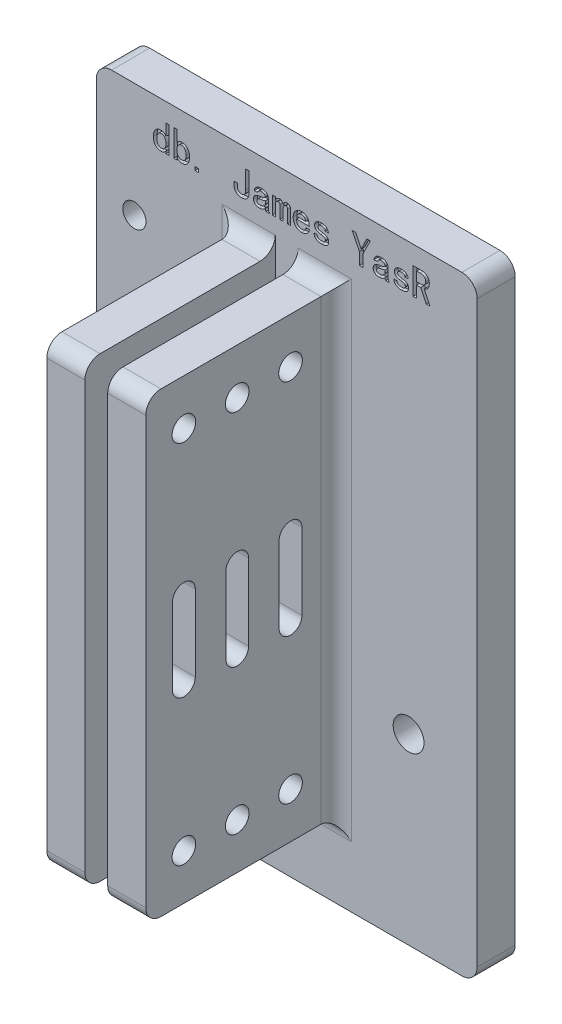
from build123d import *

# Parameters (mm, degrees)
EXTRUDE_2_DEPTH     = 60
SKETCH_2_W          = 50
SKETCH_2_H          = 5
EXTRUDE_3_DEPTH     = 10
SKETCH_4_W          = 50
SKETCH_4_H          = 5
EXTRUDE_5_DEPTH     = 10
SKETCH_5_R          = 2.025
CUT_EXTRUDE_1_DEPTH = 83.415107838
FILLET_4_R          = 2
FILLET_5_R          = 2
SKETCH_6_R          = 1.55
CUT_EXTRUDE_2_DEPTH = 83.415107838
FILLET_6_R          = 2
FILLET_7_R          = 2
FILLET_8_R          = 2
FILLET_9_R          = 2
FILLET_10_R         = 2
FILLET_11_R         = 2
CUT_EXTRUDE_3_DEPTH = 2
FILLET_12_R         = 2
SKETCH_11_R         = 1.525
CUT_EXTRUDE_4_DEPTH = 82.70832271
SKETCH_12_W         = 0.470760234
SKETCH_12_H         = 0.450292398
CUT_EXTRUDE_5_DEPTH = 0.5
SKETCH_13_W         = 0.470760234
SKETCH_13_H         = 0.450292397
CUT_EXTRUDE_6_DEPTH = 0.5


with BuildPart() as part:
    # 草图1 → 凸台-拉伸2 (new body)
    with BuildSketch(Plane(origin=(0, 0, 0), x_dir=(1, 0, 0), z_dir=(0, 1, 0))):
        Polygon((0, 0), (0, 25), (-18.5, 25), (-18.5, 30), (0, 30), (13, 30), (31.5, 30), (31.5, 25), (13, 25), (13, 0), (8, 0), (8, 25), (5, 25), (5, 0), align=None)
    extrude(amount=EXTRUDE_2_DEPTH)

    # 草图2 → 凸台-拉伸3 (add)
    with BuildSketch(Plane(origin=(0, 60, 0), x_dir=(1, 0, 0), z_dir=(0, 1, 0))):
        with Locations((6.5, 27.5)):
            Rectangle(SKETCH_2_W, SKETCH_2_H)
    extrude(amount=EXTRUDE_3_DEPTH)

    # 草图4 → 凸台-拉伸5 (add)
    with BuildSketch(Plane.XZ):
        with Locations((6.5, -27.5)):
            Rectangle(SKETCH_4_W, SKETCH_4_H)
    extrude(amount=EXTRUDE_5_DEPTH)

    # 草图5 → 切除-拉伸1 (cut, through all)
    with BuildSketch(Plane(origin=(0, 0, -30), x_dir=(-1, 0, 0), z_dir=(0, 0, -1))):
        with Locations((-22.5, 14)):
            Circle(SKETCH_5_R)
        with Locations((9.5, 46)):
            Circle(SKETCH_5_R)
    extrude(amount=-CUT_EXTRUDE_1_DEPTH, mode=Mode.SUBTRACT)

    # 圆角4
    fillet_4_edges = [part.edges().sort_by_distance(p)[0] for p in [
        (0, 30, -25),
    ]]
    fillet(fillet_4_edges, radius=FILLET_4_R)

    # 圆角5
    fillet_5_edges = [part.edges().sort_by_distance(p)[0] for p in [
        (13, 30, -25),
    ]]
    fillet(fillet_5_edges, radius=FILLET_5_R)

    # 草图6 → 切除-拉伸2 (cut, through all)
    with BuildSketch(Plane(origin=(13, 0, 0), x_dir=(0, 0, -1), z_dir=(1, 0, 0))):
        with Locations((19, 54)):
            Circle(SKETCH_6_R)
        with Locations((19, 6)):
            Circle(SKETCH_6_R)
        with Locations((12, 54)):
            Circle(SKETCH_6_R)
        with Locations((12, 6)):
            Circle(SKETCH_6_R)
        with Locations((5, 54)):
            Circle(SKETCH_6_R)
        with Locations((5, 6)):
            Circle(SKETCH_6_R)
        with BuildLine():
            Line((20.5, 35), (20.5, 25))
            ThreePointArc((20.5, 25), (19, 23.5), (17.5, 25))
            Line((17.5, 25), (17.5, 35))
            ThreePointArc((17.5, 35), (19, 36.5), (20.5, 35))
        make_face()
        with BuildLine():
            Line((13.5, 35), (13.5, 25))
            ThreePointArc((13.5, 25), (12, 23.5), (10.5, 25))
            Line((10.5, 25), (10.5, 35))
            ThreePointArc((10.5, 35), (12, 36.5), (13.5, 35))
        make_face()
        with BuildLine():
            Line((6.5, 35), (6.5, 25))
            ThreePointArc((6.5, 25), (5, 23.5), (3.5, 25))
            Line((3.5, 25), (3.5, 35))
            ThreePointArc((3.5, 35), (5, 36.5), (6.5, 35))
        make_face()
    extrude(amount=-CUT_EXTRUDE_2_DEPTH, mode=Mode.SUBTRACT)

    # 圆角6
    fillet_6_edges = [part.edges().sort_by_distance(p)[0] for p in [
        (11.5, 60, -25),
    ]]
    fillet(fillet_6_edges, radius=FILLET_6_R)

    # 圆角7
    fillet_7_edges = [part.edges().sort_by_distance(p)[0] for p in [
        (1.5, 60, -25),
    ]]
    fillet(fillet_7_edges, radius=FILLET_7_R)

    # 圆角8
    fillet_8_edges = [part.edges().sort_by_distance(p)[0] for p in [
        (1.5, 0, -25),
        (11.5, 0, -25),
    ]]
    fillet(fillet_8_edges, radius=FILLET_8_R)

    # 圆角9
    fillet_9_edges = [part.edges().sort_by_distance(p)[0] for p in [
        (31.5, 70, -27.5),
        (31.5, -10, -27.5),
    ]]
    fillet(fillet_9_edges, radius=FILLET_9_R)

    # 圆角10
    fillet_10_edges = [part.edges().sort_by_distance(p)[0] for p in [
        (-18.5, 70, -27.5),
        (-18.5, -10, -27.5),
    ]]
    fillet(fillet_10_edges, radius=FILLET_10_R)

    # 圆角11
    fillet_11_edges = [part.edges().sort_by_distance(p)[0] for p in [
        (10.5, 0, 0),
        (2.5, 0, 0),
        (10.5, 60, 0),
        (2.5, 60, 0),
    ]]
    fillet(fillet_11_edges, radius=FILLET_11_R)

    # 草图9 → 切除-拉伸3 (cut)
    with BuildSketch(Plane(origin=(0, 0, -30), x_dir=(-1, 0, 0), z_dir=(0, 0, -1))):
        with BuildLine():
            Line((18.5, 50), (10.5, 50))
            ThreePointArc((10.5, 50), (9.085786438, 50.585786438), (8.5, 52))
            Line((8.5, 52), (8.5, 58))
            ThreePointArc((8.5, 58), (9.085786438, 59.414213562), (10.5, 60))
            Line((10.5, 60), (18.5, 60))
            Line((18.5, 60), (18.5, 50))
        make_face()
        with BuildLine():
            Line((18.5, 10), (18.5, 0))
            Line((18.5, 0), (10.5, 0))
            ThreePointArc((10.5, 0), (9.085786438, 0.585786438), (8.5, 2))
            Line((8.5, 2), (8.5, 8))
            ThreePointArc((8.5, 8), (9.085786438, 9.414213562), (10.5, 10))
            Line((10.5, 10), (18.5, 10))
        make_face()
    extrude(amount=-CUT_EXTRUDE_3_DEPTH, mode=Mode.SUBTRACT)

    # 圆角12
    fillet_12_edges = [part.edges().sort_by_distance(p)[0] for p in [
        (-18.5, 60, -29),
        (-18.5, 50, -29),
        (-18.5, 10, -29),
        (-18.5, 0, -29),
    ]]
    fillet(fillet_12_edges, radius=FILLET_12_R)

    # 草图11 → 切除-拉伸4 (cut, through all)
    with BuildSketch(Plane(origin=(0, 0, -28), x_dir=(-1, 0, 0), z_dir=(0, 0, -1))):
        with Locations((13.5, 55)):
            Circle(SKETCH_11_R)
        with Locations((13.5, 5)):
            Circle(SKETCH_11_R)
    extrude(amount=-CUT_EXTRUDE_4_DEPTH, mode=Mode.SUBTRACT)

    # 草图12 → 切除-拉伸5 (cut)
    # profile 1 of 12: a face of its own
    with BuildSketch(Plane(origin=(0, 0, -30), x_dir=(-1, 0, 0), z_dir=(0, 0, -1))):
        with BuildLine():
            Line((-23.780411119, -7.269663039), (-24.189767844, -7.269663039))
            Line((-24.189767844, -7.269663039), (-24.189767844, -6.962645495))
            add(Edge.make_bspline(
                [(-24.189767844, -6.962645495), (-24.210276443, -6.99177389), (-24.250051913, -7.048267052), (-24.320098141, -7.121445241), (-24.394272047, -7.183172507), (-24.475489722, -7.230711518), (-24.562606052, -7.266615588), (-24.65674091, -7.292539704), (-24.758596637, -7.307525796), (-24.829022259, -7.30955574), (-24.86520644, -7.310598711)],
                knots=[0, 0, 0, 0, 1.072592054, 2.080242203, 3.043943068, 3.972842844, 4.90514114, 5.877265574, 6.909354224, 8, 8, 8, 8], degree=3))
            add(Edge.make_bspline(
                [(-24.86520644, -7.310598711), (-24.898603691, -7.309721269), (-24.964671069, -7.307985487), (-25.061818623, -7.294304577), (-25.154983384, -7.270564965), (-25.244320924, -7.237631074), (-25.33013213, -7.196095241), (-25.411725664, -7.144696727), (-25.489584932, -7.084450558), (-25.562832146, -7.01474769), (-25.630825506, -6.936478404), (-25.688585204, -6.847089952), (-25.738034598, -6.749034384), (-25.777817649, -6.641307239), (-25.810084937, -6.525030102), (-25.831135639, -6.399248881), (-25.845371209, -6.264539054), (-25.846882119, -6.17151558), (-25.847662581, -6.123464208)],
                knots=[0, 0, 0, 0, 0.922662305, 1.825236456, 2.704191738, 3.574590404, 4.452130007, 5.333660967, 6.234531866, 7.16804275, 8.123850807, 9.092201981, 10.10085144, 11.152662919, 12.260531245, 13.430329365, 14.672633976, 16, 16, 16, 16], degree=3))
            add(Edge.make_bspline(
                [(-25.847662581, -6.123464208), (-25.846871637, -6.075414099), (-25.845336297, -5.982141589), (-25.831158393, -5.846918316), (-25.809954716, -5.720174241), (-25.777976545, -5.602806641), (-25.737879701, -5.493937507), (-25.688409703, -5.394441703), (-25.630889285, -5.302935539), (-25.562866779, -5.222399912), (-25.489634044, -5.150419594), (-25.411766611, -5.087933335), (-25.330391257, -5.034151666), (-25.244514614, -4.991030306), (-25.155005471, -4.957442482), (-25.061862372, -4.932953595), (-24.964730679, -4.918274966), (-24.898611564, -4.916671821), (-24.86520644, -4.915861869)],
                knots=[0, 0, 0, 0, 1.316658682, 2.555833095, 3.723017293, 4.835313406, 5.885126595, 6.89802981, 7.87601679, 8.83999669, 9.780397425, 10.686873812, 11.572496565, 12.449108366, 13.314899594, 14.188496243, 15.084780451, 16, 16, 16, 16], degree=3))
            add(Edge.make_bspline(
                [(-24.86520644, -4.915861869), (-24.829022055, -4.91713828), (-24.758530329, -4.919624888), (-24.656268277, -4.935668163), (-24.562242156, -4.965928569), (-24.475166236, -5.006404628), (-24.394821951, -5.058783612), (-24.319915935, -5.122381171), (-24.250506934, -5.197866309), (-24.210360102, -5.254985262), (-24.189767844, -5.284282922)],
                knots=[0, 0, 0, 0, 1.078430322, 2.100917707, 3.072511248, 4.012306724, 4.954241423, 5.921243328, 6.933756619, 8, 8, 8, 8], degree=3))
            Line((-24.189767844, -5.284282922), (-24.189767844, -3.769663039))
            Line((-24.189767844, -3.769663039), (-23.780411119, -3.769663039))
            Line((-23.780411119, -3.769663039), (-23.780411119, -7.269663039))
        make_face()
        with BuildLine():
            add(Edge.make_bspline(
                [(-24.189767844, -6.123464208), (-24.190469337, -6.091867932), (-24.191835074, -6.030353171), (-24.1989724, -5.940596989), (-24.212953813, -5.856068727), (-24.231314908, -5.776222396), (-24.256829554, -5.701973048), (-24.285921013, -5.632216612), (-24.322097061, -5.568279637), (-24.362695414, -5.509393427), (-24.407116497, -5.456832536), (-24.453683816, -5.410417402), (-24.503183752, -5.37171544), (-24.554645854, -5.339622509), (-24.608652421, -5.314858161), (-24.66475535, -5.297673684), (-24.72326212, -5.286479279), (-24.763068263, -5.285023907), (-24.783335095, -5.284282922)],
                knots=[0, 0, 0, 0, 1.326097418, 2.58177784, 3.774124634, 4.91859917, 6.01505958, 7.06484496, 8.085469211, 9.091391489, 10.062105039, 10.969357959, 11.845402754, 12.692875275, 13.508989028, 14.330663278, 15.150076696, 16, 16, 16, 16], degree=3))
            add(Edge.make_bspline(
                [(-24.783335095, -5.284282922), (-24.808136936, -5.285031173), (-24.856459587, -5.286489026), (-24.926401882, -5.297187786), (-24.99151737, -5.314671942), (-25.05215015, -5.338853714), (-25.107745768, -5.37113959), (-25.158930356, -5.409853593), (-25.20495638, -5.456121163), (-25.245746695, -5.509233089), (-25.280997234, -5.568652545), (-25.312295237, -5.632747517), (-25.339049293, -5.701894244), (-25.359599176, -5.776734019), (-25.377766565, -5.855985053), (-25.388091951, -5.940828845), (-25.396468157, -6.030308241), (-25.397064112, -6.091854959), (-25.397370183, -6.123464208)],
                knots=[0, 0, 0, 0, 1.010921912, 1.969629055, 2.876801635, 3.754903352, 4.622548209, 5.49000956, 6.36417426, 7.274966439, 8.213139265, 9.176099125, 10.180543572, 11.230552489, 12.337923623, 13.491854139, 14.711862953, 16, 16, 16, 16], degree=3))
            add(Edge.make_bspline(
                [(-25.397370183, -6.123464208), (-25.397076672, -6.155074764), (-25.396507511, -6.216372126), (-25.388013884, -6.305584423), (-25.3779321, -6.389715012), (-25.35960331, -6.467936228), (-25.339023874, -6.541252128), (-25.312488657, -6.608752262), (-25.280915542, -6.67069065), (-25.246016461, -6.727912605), (-25.204384423, -6.778026523), (-25.159168307, -6.822844376), (-25.107424006, -6.859090153), (-25.051937795, -6.889807308), (-24.991495469, -6.913402699), (-24.926280158, -6.92976791), (-24.856494993, -6.940981159), (-24.808145213, -6.9417719), (-24.783335095, -6.942177659)],
                knots=[0, 0, 0, 0, 1.304895276, 2.530377428, 3.699320191, 4.800718009, 5.844333711, 6.842392684, 7.789844015, 8.713547088, 9.603501048, 10.474404448, 11.33454894, 12.203261069, 13.08892134, 14.005225436, 14.976405035, 16, 16, 16, 16], degree=3))
            add(Edge.make_bspline(
                [(-24.783335095, -6.942177659), (-24.76305928, -6.941775727), (-24.723221788, -6.940986019), (-24.664889554, -6.929299334), (-24.608670895, -6.913229047), (-24.554851914, -6.889067922), (-24.503474408, -6.858544971), (-24.453421172, -6.822285166), (-24.407659798, -6.777281457), (-24.362410229, -6.727775636), (-24.3221952, -6.67106235), (-24.285726899, -6.609310766), (-24.256854092, -6.541169664), (-24.231319726, -6.468456638), (-24.212769301, -6.389636474), (-24.199057815, -6.305815144), (-24.191793346, -6.216327343), (-24.190457041, -6.155061787), (-24.189767844, -6.123464208)],
                knots=[0, 0, 0, 0, 0.860589201, 1.690867361, 2.52031093, 3.342836818, 4.190451569, 5.058586136, 5.962930095, 6.914057375, 7.906986101, 8.913137908, 9.957126402, 11.047782201, 12.186538846, 13.39469517, 14.65631963, 16, 16, 16, 16], degree=3))
        make_face(mode=Mode.SUBTRACT)
    # profile 2 of 12: a face of its own
    with BuildSketch(Plane(origin=(0, 0, -30), x_dir=(-1, 0, 0), z_dir=(0, 0, -1))):
        with BuildLine():
            add(Edge.make_bspline(
                [(-21.099124569, -6.123464208), (-21.099914562, -6.171512773), (-21.101443922, -6.264530813), (-21.115550405, -6.399278659), (-21.137038435, -6.524862539), (-21.16775875, -6.641619061), (-21.209006523, -6.74884897), (-21.258127851, -6.847116595), (-21.31598121, -6.936470793), (-21.383948748, -7.014752189), (-21.457208011, -7.084440376), (-21.535045085, -7.14473145), (-21.616521015, -7.195848392), (-21.702049015, -7.238011761), (-21.791624038, -7.270377602), (-21.884954614, -7.294339927), (-21.982119688, -7.30797632), (-22.04818467, -7.309718191), (-22.081580709, -7.310598711)],
                knots=[0, 0, 0, 0, 1.327288591, 2.569520731, 3.739250609, 4.845226483, 5.899453574, 6.908044192, 7.876338876, 8.832091174, 9.765547602, 10.666365947, 11.547845482, 12.41906116, 13.295966014, 14.174870021, 15.077391519, 16, 16, 16, 16], degree=3))
            add(Edge.make_bspline(
                [(-22.081580709, -7.310598711), (-22.117765185, -7.309556081), (-22.188191379, -7.307526801), (-22.29004307, -7.292536026), (-22.384192043, -7.266628293), (-22.471258405, -7.230666223), (-22.552492969, -7.18344245), (-22.625949799, -7.120922062), (-22.696805185, -7.048581141), (-22.736568594, -6.991832089), (-22.757019306, -6.962645495)],
                knots=[0, 0, 0, 0, 1.090732123, 2.122902483, 3.09510388, 4.027475986, 4.956449303, 5.91433692, 6.927323028, 8, 8, 8, 8], degree=3))
            Line((-22.757019306, -6.962645495), (-22.757019306, -7.269663039))
            Line((-22.757019306, -7.269663039), (-23.166376031, -7.269663039))
            Line((-23.166376031, -7.269663039), (-23.166376031, -3.769663039))
            Line((-23.166376031, -3.769663039), (-22.757019306, -3.769663039))
            Line((-22.757019306, -3.769663039), (-22.757019306, -5.284282922))
            add(Edge.make_bspline(
                [(-22.757019306, -5.284282922), (-22.736486135, -5.254927749), (-22.696356081, -5.197555962), (-22.626114584, -5.122905233), (-22.551957226, -5.058506241), (-22.471580231, -5.006450132), (-22.384556271, -4.965915955), (-22.290515651, -4.935671767), (-22.188257696, -4.919623909), (-22.117765391, -4.917137948), (-22.081580709, -4.915861869)],
                knots=[0, 0, 0, 0, 1.066326398, 2.084029623, 3.045372846, 3.987380883, 4.92724953, 5.898918718, 6.921485713, 8, 8, 8, 8], degree=3))
            add(Edge.make_bspline(
                [(-22.081580709, -4.915861869), (-22.048176845, -4.916674935), (-21.982060222, -4.918284245), (-21.88491029, -4.932917753), (-21.791605249, -4.957633373), (-21.701846952, -4.990642302), (-21.616269505, -5.034405175), (-21.535003077, -5.087897541), (-21.45715922, -5.150430098), (-21.383913958, -5.222395308), (-21.315917758, -5.302943231), (-21.258302256, -5.39441487), (-21.209163774, -5.494122411), (-21.167598053, -5.602497045), (-21.137167935, -5.720339647), (-21.115528171, -5.846889014), (-21.101478508, -5.982149645), (-21.099924915, -6.075416838), (-21.099124569, -6.123464208)],
                knots=[0, 0, 0, 0, 0.915164722, 1.811395237, 2.684939553, 3.557164978, 4.427546112, 5.31311581, 6.219537894, 7.159882293, 8.123804446, 9.101732838, 10.114575375, 11.166767514, 12.277205737, 13.444320014, 14.683420194, 16, 16, 16, 16], degree=3))
        make_face()
        with BuildLine():
            add(Edge.make_bspline(
                [(-21.549416967, -6.123464208), (-21.549757025, -6.091860241), (-21.550419156, -6.030323808), (-21.558330661, -5.940736872), (-21.570299547, -5.856166632), (-21.586892054, -5.776623241), (-21.607799752, -5.701899565), (-21.634530741, -5.632779728), (-21.665645602, -5.568407557), (-21.701923743, -5.509468897), (-21.742511243, -5.456054316), (-21.788584192, -5.410132789), (-21.839104184, -5.370895639), (-21.894667259, -5.338892642), (-21.955261349, -5.314661096), (-22.020387688, -5.297190899), (-22.090326905, -5.28648818), (-22.13864999, -5.285030885), (-22.163452054, -5.284282922)],
                knots=[0, 0, 0, 0, 1.288422942, 2.508702531, 3.664314219, 4.769772076, 5.820014037, 6.824681414, 7.787854999, 8.731595528, 9.642589852, 10.516948568, 11.376425841, 12.244263267, 13.122559874, 14.029933797, 14.988853719, 16, 16, 16, 16], degree=3))
            add(Edge.make_bspline(
                [(-22.163452054, -5.284282922), (-22.183718942, -5.285023852), (-22.223525193, -5.286479115), (-22.282031174, -5.297674315), (-22.338137078, -5.314855789), (-22.392132451, -5.339631443), (-22.443638323, -5.371680161), (-22.493108528, -5.410668057), (-22.540471626, -5.45653945), (-22.584735561, -5.509473104), (-22.625676876, -5.568018834), (-22.660455679, -5.632659447), (-22.691196682, -5.701584612), (-22.71514237, -5.776426581), (-22.733932521, -5.856032626), (-22.747786297, -5.940607345), (-22.754959818, -6.030350353), (-22.75632044, -6.091866976), (-22.757019306, -6.123464208)],
                knots=[0, 0, 0, 0, 0.849745994, 1.668988466, 2.4904913, 3.306434796, 4.153730518, 5.029592553, 5.944244245, 6.914755286, 7.920467709, 8.935744791, 9.989532211, 11.082426943, 12.22666272, 13.418760768, 14.674179231, 16, 16, 16, 16], degree=3))
            add(Edge.make_bspline(
                [(-22.757019306, -6.123464208), (-22.756332796, -6.155062787), (-22.7550017, -6.216330281), (-22.747700502, -6.305804415), (-22.734118586, -6.389673959), (-22.715140066, -6.468248911), (-22.691166944, -6.541564927), (-22.660661005, -6.608860247), (-22.625570101, -6.671327398), (-22.585024429, -6.727696231), (-22.539914221, -6.777570074), (-22.493382185, -6.822037822), (-22.443346774, -6.858580554), (-22.391926509, -6.889058798), (-22.338118584, -6.913231482), (-22.281896973, -6.929298682), (-22.223565524, -6.940986189), (-22.183727925, -6.941775784), (-22.163452054, -6.942177659)],
                knots=[0, 0, 0, 0, 1.343396544, 2.60475451, 3.812655634, 4.951171738, 6.038152723, 7.086278137, 8.08686954, 9.079588529, 10.030514901, 10.942482393, 11.810433583, 12.657869292, 13.480221437, 14.309489802, 15.139592582, 16, 16, 16, 16], degree=3))
            add(Edge.make_bspline(
                [(-22.163452054, -6.942177659), (-22.138641723, -6.941772191), (-22.090291527, -6.940982019), (-22.020509305, -6.929764753), (-21.955283653, -6.913413658), (-21.894878038, -6.889768154), (-21.839438689, -6.859331588), (-21.788333827, -6.822565808), (-21.743086429, -6.778092821), (-21.701641641, -6.727675845), (-21.665735818, -6.67093989), (-21.634336939, -6.608719114), (-21.607824586, -6.541246983), (-21.586891312, -6.468048327), (-21.57013412, -6.389530908), (-21.558409501, -6.305676713), (-21.55038025, -6.21635637), (-21.54974471, -6.155069404), (-21.549416967, -6.123464208)],
                knots=[0, 0, 0, 0, 1.0238293, 1.995231234, 2.911745102, 3.797608129, 4.666519136, 5.518396606, 6.389499385, 7.279657085, 8.209156727, 9.156824961, 10.155112422, 11.198967043, 12.298389299, 13.469043285, 14.694805991, 16, 16, 16, 16], degree=3))
        make_face(mode=Mode.SUBTRACT)
    # profile 3 of 12: a face of its own
    with BuildSketch(Plane(origin=(0, 0, -30), x_dir=(-1, 0, 0), z_dir=(0, 0, -1))):
        with Locations((-20.147370183, -7.04451684)):
            Rectangle(SKETCH_12_W, SKETCH_12_H)
    # profile 4 of 12: a face of its own
    with BuildSketch(Plane(origin=(0, 0, -30), x_dir=(-1, 0, 0), z_dir=(0, 0, -1))):
        with BuildLine():
            add(Edge.make_bspline(
                [(-13.259943283, -6.102996372), (-13.260809889, -6.154068943), (-13.262485973, -6.2528473), (-13.275470817, -6.395439043), (-13.296200093, -6.527343798), (-13.326249385, -6.648516726), (-13.365733517, -6.758574291), (-13.412583827, -6.858420716), (-13.46888802, -6.947313149), (-13.534739322, -7.024729644), (-13.606943776, -7.092723117), (-13.685986907, -7.15055463), (-13.770362649, -7.200336412), (-13.861374638, -7.240285048), (-13.958107294, -7.272845602), (-14.061527162, -7.29383018), (-14.170483662, -7.308247327), (-14.245128812, -7.309802641), (-14.283335095, -7.310598711)],
                knots=[0, 0, 0, 0, 1.356136153, 2.622873634, 3.798912155, 4.89914128, 5.932854678, 6.899365407, 7.822699082, 8.718002883, 9.591565474, 10.450546657, 11.313737724, 12.187918694, 13.085558303, 14.018715857, 14.985901937, 16, 16, 16, 16], degree=3))
            add(Edge.make_bspline(
                [(-14.283335095, -7.310598711), (-14.318501612, -7.309710308), (-14.387558865, -7.307965733), (-14.48875861, -7.294671982), (-14.585639139, -7.273847984), (-14.677666371, -7.243124348), (-14.765566897, -7.204584392), (-14.848467091, -7.15612372), (-14.927481123, -7.100211292), (-15.001529779, -7.035334534), (-15.069744592, -6.961435438), (-15.127294893, -6.875032914), (-15.176940366, -6.779029481), (-15.216625426, -6.671944907), (-15.2488393, -6.554865839), (-15.269757879, -6.427033449), (-15.284011814, -6.289045098), (-15.285491459, -6.193499453), (-15.286259072, -6.143932045)],
                knots=[0, 0, 0, 0, 0.965207056, 1.895398095, 2.797616718, 3.68172986, 4.554474206, 5.427880056, 6.313380256, 7.208126351, 8.126523393, 9.065520378, 10.04910175, 11.087616577, 12.19500805, 13.377740811, 14.639617834, 16, 16, 16, 16], degree=3))
            Line((-15.286259072, -6.143932045), (-15.286259072, -5.918785846))
            Line((-15.286259072, -5.918785846), (-14.815498838, -5.918785846))
            Line((-14.815498838, -5.918785846), (-14.815498838, -6.205335553))
            add(Edge.make_bspline(
                [(-14.815498838, -6.205335553), (-14.815214182, -6.234927428), (-14.814665729, -6.291942708), (-14.806234875, -6.374085632), (-14.796264411, -6.449985895), (-14.777851814, -6.518588647), (-14.757483701, -6.581281882), (-14.73067441, -6.636885447), (-14.699669618, -6.686033863), (-14.652339541, -6.740983337), (-14.58520868, -6.7957646), (-14.497575973, -6.844823222), (-14.402792859, -6.875244379), (-14.337125466, -6.878912688), (-14.303802932, -6.88077415)],
                knots=[0, 0, 0, 0, 1.112081592, 2.142670774, 3.103485674, 3.986135228, 4.809458143, 5.578697135, 6.30090008, 6.988324459, 8.297374279, 9.53498768, 10.749143895, 12, 12, 12, 12], degree=3))
            add(Edge.make_bspline(
                [(-14.303802932, -6.88077415), (-14.280514064, -6.880559187), (-14.235540405, -6.880144067), (-14.170602026, -6.870673616), (-14.109543364, -6.859704299), (-14.053448814, -6.840836075), (-14.000989633, -6.818629579), (-13.954371478, -6.789169354), (-13.910789974, -6.75664855), (-13.872718511, -6.717363679), (-13.838434086, -6.671497861), (-13.809125934, -6.617656245), (-13.785108994, -6.555045296), (-13.764582713, -6.484891519), (-13.7500856, -6.406083091), (-13.738564215, -6.319330973), (-13.73192221, -6.224136994), (-13.731119651, -6.157839886), (-13.730703516, -6.123464208)],
                knots=[0, 0, 0, 0, 1.017815291, 1.965526091, 2.867630955, 3.727831726, 4.549652666, 5.353726799, 6.134424588, 6.924153485, 7.737976159, 8.633688341, 9.596692495, 10.667485393, 11.827662533, 13.09906345, 14.495836962, 16, 16, 16, 16], degree=3))
            Line((-13.730703516, -6.123464208), (-13.730703516, -3.769663039))
            Line((-13.730703516, -3.769663039), (-13.259943283, -3.769663039))
            Line((-13.259943283, -3.769663039), (-13.259943283, -6.102996372))
        make_face()
    # profile 5 of 12: a face of its own
    with BuildSketch(Plane(origin=(0, 0, -30), x_dir=(-1, 0, 0), z_dir=(0, 0, -1))):
        with BuildLine():
            Line((-10.578656733, -7.269663039), (-11.069884803, -7.269663039))
            add(Edge.make_bspline(
                [(-11.069884803, -7.269663039), (-11.082653809, -7.254033709), (-11.109995483, -7.220567361), (-11.134529574, -7.153902392), (-11.149150568, -7.073498552), (-11.150843115, -7.014785607), (-11.151756148, -6.983113331)],
                knots=[0, 0, 0, 0, 0.789878128, 1.691328897, 2.754604006, 4, 4, 4, 4], degree=3))
            add(Edge.make_bspline(
                [(-11.151756148, -6.983113331), (-11.176461797, -7.009220126), (-11.225518325, -7.061058826), (-11.309072008, -7.12841421), (-11.400802463, -7.184545312), (-11.499236846, -7.230765243), (-11.602953889, -7.265794777), (-11.709406007, -7.29193471), (-11.818654588, -7.307412036), (-11.892340392, -7.309529768), (-11.929533926, -7.310598711)],
                knots=[0, 0, 0, 0, 0.99108684, 1.967941849, 2.951023905, 3.952360611, 4.962327917, 5.966937013, 6.973794236, 8, 8, 8, 8], degree=3))
            add(Edge.make_bspline(
                [(-11.929533926, -7.310598711), (-11.95635115, -7.310346049), (-12.009112864, -7.309848948), (-12.086187171, -7.300482913), (-12.16046823, -7.289344299), (-12.230899837, -7.270399295), (-12.29904338, -7.248319121), (-12.363033531, -7.218689463), (-12.425257884, -7.186804182), (-12.482397752, -7.147702605), (-12.535671201, -7.105381254), (-12.581575856, -7.056979369), (-12.620273011, -7.004402354), (-12.652969677, -6.947760598), (-12.676750146, -6.885961653), (-12.694436569, -6.819924023), (-12.705055942, -6.749463376), (-12.706549216, -6.700895327), (-12.707311704, -6.676095787)],
                knots=[0, 0, 0, 0, 1.138937901, 2.240810461, 3.296706705, 4.328288106, 5.337028069, 6.337039161, 7.321998526, 8.30502355, 9.274578604, 10.208993102, 11.130541657, 12.044422553, 12.979824152, 13.93596077, 14.946072082, 16, 16, 16, 16], degree=3))
            add(Edge.make_bspline(
                [(-12.707311704, -6.676095787), (-12.706850297, -6.651038235), (-12.705951591, -6.602232286), (-12.695412164, -6.53099304), (-12.680065806, -6.463209862), (-12.656866466, -6.399740225), (-12.629123719, -6.339349097), (-12.592609544, -6.284094801), (-12.551279491, -6.231559185), (-12.502788239, -6.183410919), (-12.447762447, -6.139058557), (-12.385443193, -6.09926897), (-12.316414821, -6.062747045), (-12.24080665, -6.02890159), (-12.157039521, -6.001959883), (-12.067193404, -5.976410434), (-11.970192843, -5.955360357), (-11.902807786, -5.944726187), (-11.868130417, -5.939253682)],
                knots=[0, 0, 0, 0, 0.970200953, 1.889712841, 2.785134063, 3.658547137, 4.503899677, 5.35405909, 6.218090441, 7.090514932, 7.995840025, 8.951904317, 9.950690379, 11.020488193, 12.156911096, 13.356703322, 14.639719563, 16, 16, 16, 16], degree=3))
            add(Edge.make_bspline(
                [(-11.868130417, -5.939253682), (-11.821840134, -5.932208678), (-11.732086495, -5.918548904), (-11.602204432, -5.89401494), (-11.481107882, -5.868164677), (-11.386877421, -5.842933673), (-11.318034754, -5.822565408), (-11.274565884, -5.804509423), (-11.236687552, -5.787166028), (-11.206819214, -5.766330012), (-11.181736171, -5.746079389), (-11.165290373, -5.722777847), (-11.153101634, -5.69880544), (-11.152201193, -5.681650618), (-11.151756148, -5.673171811)],
                knots=[0, 0, 0, 0, 2.107111613, 4.085542931, 5.948146815, 7.677718057, 8.476216546, 9.175223692, 9.795721221, 10.344548113, 10.812061436, 11.235137722, 11.621965202, 12, 12, 12, 12], degree=3))
            add(Edge.make_bspline(
                [(-11.151756148, -5.673171811), (-11.153102105, -5.652616488), (-11.155836027, -5.610864288), (-11.172965045, -5.548080384), (-11.204039502, -5.486962626), (-11.235898629, -5.435559477), (-11.270400718, -5.397416212), (-11.303920369, -5.371844398), (-11.344421435, -5.351192099), (-11.391089574, -5.333377663), (-11.44476202, -5.321305477), (-11.504666574, -5.311014436), (-11.571657914, -5.306380211), (-11.618470489, -5.305310775), (-11.642984218, -5.304750758)],
                knots=[0, 0, 0, 0, 1.061145256, 2.155409969, 3.32744696, 4.58942469, 5.262953509, 5.969609087, 6.751075837, 7.600992533, 8.540118245, 9.583902906, 10.734794012, 12, 12, 12, 12], degree=3))
            add(Edge.make_bspline(
                [(-11.642984218, -5.304750758), (-11.681196963, -5.305910751), (-11.752479991, -5.308074631), (-11.851948492, -5.32377435), (-11.935031716, -5.35275826), (-12.002180466, -5.394228232), (-12.055213899, -5.446229853), (-12.097491938, -5.507084614), (-12.132632989, -5.57604261), (-12.147177528, -5.626616263), (-12.154680125, -5.652703974)],
                knots=[0, 0, 0, 0, 1.349357617, 2.517126105, 3.541790225, 4.435668764, 5.281297301, 6.145416033, 7.043338789, 8, 8, 8, 8], degree=3))
            Line((-12.154680125, -5.652703974), (-12.604972522, -5.652703974))
            add(Edge.make_bspline(
                [(-12.604972522, -5.652703974), (-12.600963984, -5.626061656), (-12.593057938, -5.573514979), (-12.572069801, -5.497778758), (-12.545836436, -5.425552131), (-12.511380637, -5.358256287), (-12.470934249, -5.294668032), (-12.423847047, -5.235294993), (-12.369396873, -5.180532412), (-12.308954937, -5.129748467), (-12.242329468, -5.08443093), (-12.170545042, -5.045117504), (-12.094605962, -5.010370496), (-12.013331661, -4.983694932), (-11.92750394, -4.962027233), (-11.836950262, -4.947372136), (-11.741480716, -4.937927247), (-11.676362827, -4.936871082), (-11.642984218, -4.936329705)],
                knots=[0, 0, 0, 0, 0.976819435, 1.926582151, 2.846303078, 3.760752567, 4.66372935, 5.577350991, 6.504537603, 7.461355947, 8.437960182, 9.422965099, 10.428455749, 11.463610819, 12.52217693, 13.637668652, 14.789098731, 16, 16, 16, 16], degree=3))
            add(Edge.make_bspline(
                [(-11.642984218, -4.936329705), (-11.606570485, -4.93679112), (-11.536125789, -4.937683756), (-11.433825434, -4.947980426), (-11.338520003, -4.963527413), (-11.250035194, -4.985140674), (-11.168812867, -5.014252729), (-11.094499413, -5.049614828), (-11.027153185, -5.091650813), (-10.966752922, -5.139623739), (-10.913783422, -5.193509444), (-10.867439578, -5.252605537), (-10.829115279, -5.317308446), (-10.796700547, -5.386694663), (-10.772829277, -5.461445952), (-10.755268522, -5.541106326), (-10.744642862, -5.625887001), (-10.743158449, -5.68425972), (-10.742399423, -5.714107483)],
                knots=[0, 0, 0, 0, 1.288108676, 2.491928619, 3.634130004, 4.703295623, 5.710185913, 6.682043497, 7.609962811, 8.513477874, 9.405011161, 10.277874372, 11.164235917, 12.060420558, 12.982245169, 13.934656988, 14.943926699, 16, 16, 16, 16], degree=3))
            Line((-10.742399423, -5.714107483), (-10.742399423, -6.839838477))
            add(Edge.make_bspline(
                [(-10.742399423, -6.839838477), (-10.742146945, -6.859844295), (-10.741649222, -6.899282755), (-10.732191792, -6.956884872), (-10.721128937, -7.012639988), (-10.695415806, -7.083862717), (-10.651040297, -7.172062186), (-10.603455085, -7.236225334), (-10.578656733, -7.269663039)],
                knots=[0, 0, 0, 0, 0.765934861, 1.509925364, 2.233966793, 2.941750286, 4.406236969, 6, 6, 6, 6], degree=3))
        make_face()
        with BuildLine():
            Line((-11.151756148, -6.512353097), (-11.151756148, -6.102996372))
            add(Edge.make_bspline(
                [(-11.151756148, -6.102996372), (-11.191872495, -6.116072437), (-11.270005733, -6.141540243), (-11.370529774, -6.171275203), (-11.45940306, -6.192957131), (-11.54462559, -6.208720657), (-11.648537704, -6.228315886), (-11.724558563, -6.239957159), (-11.765791236, -6.246271226)],
                knots=[0, 0, 0, 0, 1.202468659, 2.342007065, 2.986514694, 3.808474686, 4.811346672, 6, 6, 6, 6], degree=3))
            add(Edge.make_bspline(
                [(-11.765791236, -6.246271226), (-11.79032837, -6.24989219), (-11.837271251, -6.256819588), (-11.904172683, -6.269420224), (-11.964085108, -6.284655692), (-12.017625961, -6.301208569), (-12.06463002, -6.319577407), (-12.104457491, -6.341262519), (-12.138206015, -6.363583203), (-12.173645757, -6.396011871), (-12.206563501, -6.441931485), (-12.236737143, -6.501287655), (-12.253261303, -6.566824308), (-12.255750198, -6.612082568), (-12.257019306, -6.635160115)],
                knots=[0, 0, 0, 0, 1.276296596, 2.441729226, 3.50138554, 4.455500742, 5.324768291, 6.092724628, 6.78519533, 7.401851409, 8.553932685, 9.670462712, 10.812150387, 12, 12, 12, 12], degree=3))
            add(Edge.make_bspline(
                [(-12.257019306, -6.635160115), (-12.255729834, -6.654968001), (-12.253170759, -6.694278568), (-12.236350978, -6.75152803), (-12.20602857, -6.803908701), (-12.166432466, -6.852982031), (-12.113342849, -6.893390759), (-12.048458237, -6.922796288), (-11.971983957, -6.938772008), (-11.917477192, -6.940998181), (-11.888598253, -6.942177659)],
                knots=[0, 0, 0, 0, 0.882749856, 1.751898097, 2.628885817, 3.56440472, 4.543936804, 5.571648779, 6.713403652, 8, 8, 8, 8], degree=3))
            add(Edge.make_bspline(
                [(-11.888598253, -6.942177659), (-11.857162988, -6.941067202), (-11.792436494, -6.938780728), (-11.694189162, -6.91729151), (-11.592153464, -6.885266851), (-11.487902369, -6.841549662), (-11.386499021, -6.783373841), (-11.294687257, -6.70854372), (-11.215176428, -6.617438923), (-11.173226607, -6.547929113), (-11.151756148, -6.512353097)],
                knots=[0, 0, 0, 0, 0.843781446, 1.7373804, 2.690966208, 3.716364983, 4.769232083, 5.821310551, 6.884918692, 8, 8, 8, 8], degree=3))
        make_face(mode=Mode.SUBTRACT)
    # profile 6 of 12: a face of its own
    with BuildSketch(Plane(origin=(0, 0, -30), x_dir=(-1, 0, 0), z_dir=(0, 0, -1))):
        with BuildLine():
            Line((-7.815498838, -7.269663039), (-8.224855563, -7.269663039))
            Line((-8.224855563, -7.269663039), (-8.224855563, -5.611768302))
            add(Edge.make_bspline(
                [(-8.224855563, -5.611768302), (-8.225198429, -5.592033951), (-8.225856238, -5.554172386), (-8.233417177, -5.4999609), (-8.246313139, -5.451057188), (-8.263771447, -5.40720685), (-8.289709382, -5.369680675), (-8.327522693, -5.342719104), (-8.375684825, -5.327888521), (-8.410729533, -5.326150947), (-8.429533926, -5.325218594)],
                knots=[0, 0, 0, 0, 1.172990478, 2.250454306, 3.245547364, 4.174930135, 5.046638938, 5.918347741, 6.883020922, 8, 8, 8, 8], degree=3))
            add(Edge.make_bspline(
                [(-8.429533926, -5.325218594), (-8.453335316, -5.327183806), (-8.501665215, -5.331174266), (-8.571205917, -5.362847234), (-8.637341036, -5.412169115), (-8.698914354, -5.479206649), (-8.752840234, -5.560741489), (-8.790722603, -5.656749516), (-8.814743801, -5.763461032), (-8.817166816, -5.838798235), (-8.818422815, -5.877850173)],
                knots=[0, 0, 0, 0, 0.766913604, 1.557256011, 2.427911044, 3.421802423, 4.484200412, 5.568564768, 6.739636535, 8, 8, 8, 8], degree=3))
            Line((-8.818422815, -5.877850173), (-8.818422815, -7.269663039))
            Line((-8.818422815, -7.269663039), (-9.22777954, -7.269663039))
            Line((-9.22777954, -7.269663039), (-9.22777954, -5.611768302))
            add(Edge.make_bspline(
                [(-9.22777954, -5.611768302), (-9.228122406, -5.592033951), (-9.228780215, -5.554172386), (-9.236341153, -5.4999609), (-9.249237116, -5.451057188), (-9.266695423, -5.40720685), (-9.292633358, -5.369680675), (-9.33044667, -5.342719104), (-9.378608801, -5.327888521), (-9.41365351, -5.326150947), (-9.432457902, -5.325218594)],
                knots=[0, 0, 0, 0, 1.172990478, 2.250454306, 3.245547364, 4.174930135, 5.046638938, 5.918347741, 6.883020922, 8, 8, 8, 8], degree=3))
            add(Edge.make_bspline(
                [(-9.432457902, -5.325218594), (-9.456259292, -5.327183806), (-9.504589191, -5.331174266), (-9.574129893, -5.362847234), (-9.640265012, -5.412169115), (-9.701838331, -5.479206649), (-9.755764211, -5.560741489), (-9.79364658, -5.656749516), (-9.817667777, -5.763461032), (-9.820090793, -5.838798235), (-9.821346791, -5.877850173)],
                knots=[0, 0, 0, 0, 0.766913604, 1.557256011, 2.427911044, 3.421802423, 4.484200412, 5.568564768, 6.739636535, 8, 8, 8, 8], degree=3))
            Line((-9.821346791, -5.877850173), (-9.821346791, -7.269663039))
            Line((-9.821346791, -7.269663039), (-10.230703516, -7.269663039))
            Line((-10.230703516, -7.269663039), (-10.230703516, -4.977265378))
            Line((-10.230703516, -4.977265378), (-9.821346791, -4.977265378))
            Line((-9.821346791, -4.977265378), (-9.821346791, -5.284282922))
            add(Edge.make_bspline(
                [(-9.821346791, -5.284282922), (-9.803994505, -5.258066495), (-9.770013374, -5.206726639), (-9.709950449, -5.138558095), (-9.646588562, -5.077773608), (-9.57719588, -5.027777447), (-9.504255304, -4.98732775), (-9.42833202, -4.957019173), (-9.349039906, -4.940225028), (-9.295572487, -4.937632141), (-9.268715212, -4.936329705)],
                knots=[0, 0, 0, 0, 1.105035383, 2.164000341, 3.189319476, 4.188868779, 5.163914028, 6.118307184, 7.054804926, 8, 8, 8, 8], degree=3))
            add(Edge.make_bspline(
                [(-9.268715212, -4.936329705), (-9.242355837, -4.937561007), (-9.191353772, -4.939943422), (-9.117575794, -4.956518963), (-9.051076489, -4.986697988), (-8.991423436, -5.027544947), (-8.938235861, -5.077402635), (-8.896141761, -5.138735146), (-8.860920582, -5.207601985), (-8.846387393, -5.258188549), (-8.838890651, -5.284282922)],
                knots=[0, 0, 0, 0, 1.054125019, 2.039598852, 3.00311637, 3.956135942, 4.921083366, 5.899693326, 6.916586166, 8, 8, 8, 8], degree=3))
            add(Edge.make_bspline(
                [(-8.838890651, -5.284282922), (-8.821713637, -5.258136254), (-8.78826985, -5.207228479), (-8.730686851, -5.138768822), (-8.670388217, -5.078391275), (-8.605403046, -5.02759781), (-8.53625324, -4.987471083), (-8.463508692, -4.956631625), (-8.386035829, -4.940231609), (-8.333326227, -4.93763836), (-8.306726908, -4.936329705)],
                knots=[0, 0, 0, 0, 1.127724244, 2.195688248, 3.220611048, 4.201621127, 5.161610027, 6.097757614, 7.040054382, 8, 8, 8, 8], degree=3))
            add(Edge.make_bspline(
                [(-8.306726908, -4.936329705), (-8.268166773, -4.937730408), (-8.195179644, -4.940381677), (-8.093173682, -4.965356701), (-8.006171308, -5.007433376), (-7.935416057, -5.067468537), (-7.880866677, -5.142877119), (-7.841760707, -5.232206243), (-7.819258219, -5.335743645), (-7.816797152, -5.409248682), (-7.815498838, -5.448025612)],
                knots=[0, 0, 0, 0, 1.141342915, 2.160348787, 3.088109297, 3.980870533, 4.881139354, 5.823297628, 6.851700002, 8, 8, 8, 8], degree=3))
            Line((-7.815498838, -5.448025612), (-7.815498838, -7.269663039))
        make_face()
    # profile 7 of 12: a face of its own
    with BuildSketch(Plane(origin=(0, 0, -30), x_dir=(-1, 0, 0), z_dir=(0, 0, -1))):
        with BuildLine():
            add(Edge.make_bspline(
                [(-5.359358487, -6.491885261), (-5.363632332, -6.522048883), (-5.372000556, -6.581109506), (-5.393398854, -6.667080412), (-5.423070079, -6.74829079), (-5.460329014, -6.825309392), (-5.505359498, -6.897668133), (-5.557921496, -6.965761337), (-5.618971743, -7.028409491), (-5.686386727, -7.086816321), (-5.759072994, -7.139117963), (-5.835567126, -7.185193384), (-5.915512121, -7.223930785), (-5.998669208, -7.255758804), (-6.085227546, -7.280158435), (-6.174745952, -7.297402539), (-6.267508565, -7.308334639), (-6.330413285, -7.309837382), (-6.362282464, -7.310598711)],
                knots=[0, 0, 0, 0, 1.027349721, 2.01155929, 2.982460583, 3.939488989, 4.892865183, 5.852926488, 6.835695019, 7.838993092, 8.858780706, 9.852982506, 10.848134193, 11.851939219, 12.853170615, 13.878076749, 14.924978104, 16, 16, 16, 16], degree=3))
            add(Edge.make_bspline(
                [(-6.362282464, -7.310598711), (-6.402245027, -7.309464949), (-6.480913808, -7.307233067), (-6.596266318, -7.293055748), (-6.706179842, -7.26788376), (-6.810346917, -7.232678166), (-6.909732447, -7.189127942), (-7.00269984, -7.133512202), (-7.090905983, -7.069230603), (-7.17279242, -6.99482936), (-7.246820467, -6.911799564), (-7.311789497, -6.82091397), (-7.366840803, -6.722671707), (-7.410360769, -6.616481461), (-7.445599002, -6.503701198), (-7.47054874, -6.383391293), (-7.484716392, -6.255708512), (-7.486897495, -6.168225156), (-7.488013458, -6.123464208)],
                knots=[0, 0, 0, 0, 1.040596851, 2.04847933, 3.020502779, 3.971363387, 4.907980749, 5.840057472, 6.786262787, 7.745802473, 8.715127679, 9.677325563, 10.649349012, 11.640338409, 12.660070572, 13.722080277, 14.834500087, 16, 16, 16, 16], degree=3))
            add(Edge.make_bspline(
                [(-7.488013458, -6.123464208), (-7.486897516, -6.078703242), (-7.484716456, -5.991219848), (-7.470548503, -5.863537333), (-7.445599831, -5.743226482), (-7.41035784, -5.630449555), (-7.366851322, -5.524247372), (-7.311751198, -5.426048443), (-7.247071737, -5.335156654), (-7.172522561, -5.252843779), (-7.090933061, -5.178442001), (-7.002719102, -5.11411944), (-6.909541149, -5.058735069), (-6.810548756, -5.014052878), (-6.706151326, -4.979108207), (-6.596274301, -4.953854878), (-6.480911705, -4.939700035), (-6.402244319, -4.937465046), (-6.362282464, -4.936329705)],
                knots=[0, 0, 0, 0, 1.165660393, 2.278233374, 3.34038931, 4.360261882, 5.35138773, 6.32354502, 7.28587539, 8.250430597, 9.210102404, 10.156438004, 11.088643066, 12.028089788, 12.979081321, 13.951238611, 14.959259867, 16, 16, 16, 16], degree=3))
            add(Edge.make_bspline(
                [(-6.362282464, -4.936329705), (-6.327115476, -4.937208523), (-6.258308007, -4.938928011), (-6.157606182, -4.952252787), (-6.061735679, -4.973040206), (-5.970720676, -5.003565418), (-5.885005946, -5.043463875), (-5.803067511, -5.090459807), (-5.726212279, -5.146825077), (-5.65488749, -5.212433978), (-5.588314907, -5.286759933), (-5.532531968, -5.374115058), (-5.485774656, -5.472196353), (-5.445840136, -5.580609995), (-5.41613096, -5.700642559), (-5.395335555, -5.831770933), (-5.382348389, -5.973865129), (-5.380687347, -6.072391691), (-5.379826323, -6.123464208)],
                knots=[0, 0, 0, 0, 0.961853369, 1.881955225, 2.774289025, 3.64221309, 4.502170827, 5.357111915, 6.222720041, 7.103517113, 8.004910372, 8.944518588, 9.927773937, 10.973225551, 12.099998938, 13.304751728, 14.602883209, 16, 16, 16, 16], degree=3))
            Line((-5.379826323, -6.123464208), (-7.03772106, -6.123464208))
            add(Edge.make_bspline(
                [(-7.03772106, -6.123464208), (-7.037185572, -6.159619264), (-7.036153942, -6.229272739), (-7.027016511, -6.329592404), (-7.01214474, -6.421643859), (-6.991155193, -6.50548188), (-6.96377336, -6.581207853), (-6.930825708, -6.648987105), (-6.891099894, -6.708290524), (-6.844924499, -6.758576168), (-6.794643503, -6.801774504), (-6.741159377, -6.839099223), (-6.68517107, -6.871054432), (-6.625950342, -6.897096766), (-6.56403046, -6.917508207), (-6.499280052, -6.931908973), (-6.431743403, -6.94035639), (-6.385806858, -6.941560848), (-6.362282464, -6.942177659)],
                knots=[0, 0, 0, 0, 1.434506736, 2.763607411, 3.993409065, 5.131618222, 6.18794797, 7.183511767, 8.115214969, 9.009640329, 9.884113171, 10.74092981, 11.59415958, 12.438206608, 13.303896363, 14.177276149, 15.066571621, 16, 16, 16, 16], degree=3))
            add(Edge.make_bspline(
                [(-6.362282464, -6.942177659), (-6.326275705, -6.941077498), (-6.2571112, -6.938964226), (-6.158611541, -6.917008019), (-6.069899919, -6.88245611), (-5.991932717, -6.832379602), (-5.92565628, -6.767802888), (-5.872854794, -6.688340001), (-5.831876682, -6.595586262), (-5.817258337, -6.52738007), (-5.809650885, -6.491885261)],
                knots=[0, 0, 0, 0, 1.098641888, 2.110354387, 3.066720321, 3.994127016, 4.922369068, 5.873233211, 6.893221014, 8, 8, 8, 8], degree=3))
            Line((-5.809650885, -6.491885261), (-5.359358487, -6.491885261))
        make_face()
        with BuildLine():
            add(Edge.make_bspline(
                [(-5.850586557, -5.795978828), (-5.854434415, -5.772950116), (-5.861868851, -5.72845639), (-5.875783954, -5.664648894), (-5.894144225, -5.606327785), (-5.916056258, -5.553743923), (-5.940190287, -5.505877694), (-5.968163482, -5.464080254), (-5.999808115, -5.427985267), (-6.045270298, -5.386381523), (-6.11111429, -5.345043886), (-6.199324284, -5.309197403), (-6.298083422, -5.287573941), (-6.36722389, -5.285409645), (-6.403218136, -5.284282922)],
                knots=[0, 0, 0, 0, 0.998024439, 1.928280856, 2.789163159, 3.607594607, 4.361234397, 5.077243529, 5.750938548, 6.408507414, 7.705870388, 9.047793964, 10.463093576, 12, 12, 12, 12], degree=3))
            add(Edge.make_bspline(
                [(-6.403218136, -5.284282922), (-6.436695086, -5.285458032), (-6.502337178, -5.287762204), (-6.59825228, -5.310132369), (-6.688625094, -5.345896346), (-6.759746424, -5.386751151), (-6.811887119, -5.42800351), (-6.849611305, -5.463941775), (-6.884312391, -5.505728507), (-6.916326887, -5.553331066), (-6.945596236, -5.606146327), (-6.97228275, -5.664487514), (-6.996466507, -5.728093426), (-7.010185686, -5.772897614), (-7.017253224, -5.795978828)],
                knots=[0, 0, 0, 0, 1.385517069, 2.71674218, 4.05658904, 5.403619241, 6.09706999, 6.80808912, 7.55894161, 8.343156033, 9.182291655, 10.058507014, 10.999825318, 12, 12, 12, 12], degree=3))
            Line((-7.017253224, -5.795978828), (-5.850586557, -5.795978828))
        make_face(mode=Mode.SUBTRACT)
    # profile 8 of 12: a face of its own
    with BuildSketch(Plane(origin=(0, 0, -30), x_dir=(-1, 0, 0), z_dir=(0, 0, -1))):
        with BuildLine():
            add(Edge.make_bspline(
                [(-2.821346791, -6.635160115), (-2.8219677, -6.661741488), (-2.823175131, -6.713432168), (-2.835697194, -6.788791629), (-2.856103546, -6.858890042), (-2.88354787, -6.925006821), (-2.920192553, -6.98546966), (-2.964685295, -7.041603288), (-3.017496023, -7.092407305), (-3.077376684, -7.138433964), (-3.143032901, -7.17908961), (-3.213596742, -7.21390494), (-3.287803937, -7.244662754), (-3.366904621, -7.26850113), (-3.44972737, -7.287452228), (-3.536563302, -7.301311038), (-3.627808613, -7.308523862), (-3.690081646, -7.30989661), (-3.721931587, -7.310598711)],
                knots=[0, 0, 0, 0, 1.007295538, 1.958807447, 2.886770928, 3.771318212, 4.665313464, 5.558743627, 6.480352479, 7.436773339, 8.417978872, 9.403619518, 10.417909932, 11.460591322, 12.532196943, 13.638127565, 14.792005244, 16, 16, 16, 16], degree=3))
            add(Edge.make_bspline(
                [(-3.721931587, -7.310598711), (-3.761622084, -7.310050365), (-3.838838435, -7.308983579), (-3.951242333, -7.299762821), (-4.056860731, -7.284810859), (-4.155498565, -7.263834975), (-4.247056805, -7.236532363), (-4.33160277, -7.203201848), (-4.409226257, -7.163922947), (-4.479537086, -7.118337057), (-4.54187326, -7.066458083), (-4.59700151, -7.009782929), (-4.642880175, -6.946846945), (-4.680283032, -6.878480171), (-4.710091893, -6.805063542), (-4.730124661, -6.725700047), (-4.743726851, -6.641442452), (-4.744782342, -6.583163342), (-4.745323399, -6.55328877)],
                knots=[0, 0, 0, 0, 1.320389299, 2.568767096, 3.749429958, 4.867455406, 5.920764736, 6.924630193, 7.887194276, 8.810630911, 9.706245377, 10.580331437, 11.434582315, 12.288750445, 13.167715313, 14.062935079, 15.007037213, 16, 16, 16, 16], degree=3))
            Line((-4.745323399, -6.55328877), (-4.335966674, -6.55328877))
            add(Edge.make_bspline(
                [(-4.335966674, -6.55328877), (-4.335311065, -6.573022518), (-4.334061896, -6.610622363), (-4.326625515, -6.664883961), (-4.313313821, -6.713946583), (-4.293880689, -6.75792808), (-4.270095294, -6.797416917), (-4.238430073, -6.829834888), (-4.203887262, -6.859820851), (-4.147260466, -6.889313221), (-4.069426345, -6.91878576), (-3.968199039, -6.944552014), (-3.85808047, -6.959669088), (-3.781867529, -6.961630003), (-3.742399423, -6.962645495)],
                knots=[0, 0, 0, 0, 0.861820289, 1.642075717, 2.386310159, 3.073112244, 3.737475801, 4.385510698, 5.043890949, 5.72553238, 7.157890944, 8.672672008, 10.276889312, 12, 12, 12, 12], degree=3))
            add(Edge.make_bspline(
                [(-3.742399423, -6.962645495), (-3.703932993, -6.961475622), (-3.631647532, -6.959277218), (-3.530573276, -6.943454022), (-3.444593879, -6.914956524), (-3.374208502, -6.874509251), (-3.319243153, -6.824606949), (-3.27930066, -6.767523048), (-3.255268184, -6.703163504), (-3.252553438, -6.658101382), (-3.251171353, -6.635160115)],
                knots=[0, 0, 0, 0, 1.395359583, 2.622135975, 3.697684415, 4.663085184, 5.545530932, 6.369416525, 7.169864869, 8, 8, 8, 8], degree=3))
            add(Edge.make_bspline(
                [(-3.251171353, -6.635160115), (-3.252243623, -6.617774504), (-3.254441393, -6.582140218), (-3.276667706, -6.530221716), (-3.308722775, -6.478358805), (-3.345757786, -6.436082548), (-3.385010031, -6.402927812), (-3.426074792, -6.380260524), (-3.47555018, -6.357257606), (-3.535057662, -6.336442861), (-3.603958979, -6.316955617), (-3.682493547, -6.29907838), (-3.770387997, -6.281412352), (-3.832564671, -6.271790423), (-3.86520644, -6.266739062)],
                knots=[0, 0, 0, 0, 0.800329266, 1.64038879, 2.574626408, 3.61815429, 4.224290596, 4.941994935, 5.778795243, 6.747496894, 7.853754282, 9.0899661, 10.472278272, 12, 12, 12, 12], degree=3))
            add(Edge.make_bspline(
                [(-3.86520644, -6.266739062), (-3.902906467, -6.261234544), (-3.975523499, -6.250631851), (-4.07961305, -6.230377407), (-4.174254434, -6.206241468), (-4.259959124, -6.178999715), (-4.336552205, -6.148425181), (-4.403582826, -6.113585271), (-4.461459108, -6.07540648), (-4.510644271, -6.033388376), (-4.55183336, -5.98731163), (-4.586984399, -5.938021265), (-4.617741418, -5.885837195), (-4.641699151, -5.829341208), (-4.660834754, -5.76973781), (-4.674617938, -5.706563953), (-4.681829418, -5.639731028), (-4.683214072, -5.594095211), (-4.683919891, -5.570832629)],
                knots=[0, 0, 0, 0, 1.51970126, 2.927217903, 4.227844356, 5.413685599, 6.51244671, 7.513361169, 8.421955851, 9.272562942, 10.086234328, 10.88069834, 11.684633835, 12.497305624, 13.322939306, 14.179023487, 15.071768223, 16, 16, 16, 16], degree=3))
            add(Edge.make_bspline(
                [(-4.683919891, -5.570832629), (-4.683106551, -5.550583174), (-4.681489103, -5.510314064), (-4.671080805, -5.450682085), (-4.651213662, -5.393287214), (-4.625745022, -5.337154216), (-4.592365937, -5.282694757), (-4.552337798, -5.229563897), (-4.503875204, -5.178706738), (-4.448909133, -5.129646024), (-4.386956193, -5.083859558), (-4.317197259, -5.044668822), (-4.241350022, -5.010139833), (-4.158290709, -4.983370822), (-4.068846592, -4.961928155), (-3.972743441, -4.947226684), (-3.869938909, -4.937914216), (-3.799275866, -4.936868502), (-3.762867259, -4.936329705)],
                knots=[0, 0, 0, 0, 0.782135493, 1.555394968, 2.326805275, 3.121440271, 3.931384358, 4.788115298, 5.685501255, 6.639258933, 7.630705758, 8.653399172, 9.723409504, 10.843501519, 12.017384239, 13.271878614, 14.59435579, 16, 16, 16, 16], degree=3))
            add(Edge.make_bspline(
                [(-3.762867259, -4.936329705), (-3.72974906, -4.936961408), (-3.664922179, -4.938197927), (-3.570410073, -4.946376041), (-3.481174689, -4.960661555), (-3.397819417, -4.981124667), (-3.319594769, -5.006925058), (-3.24702314, -5.03865653), (-3.179503977, -5.075894112), (-3.118391806, -5.119290513), (-3.062571623, -5.166604154), (-3.015088927, -5.219470312), (-2.973284522, -5.274636171), (-2.940510131, -5.334886279), (-2.914818438, -5.398787994), (-2.895542009, -5.466278457), (-2.885023468, -5.537905286), (-2.883521187, -5.58671954), (-2.8827503, -5.611768302)],
                knots=[0, 0, 0, 0, 1.273688351, 2.493168239, 3.645102462, 4.745845434, 5.790730293, 6.809065336, 7.787913982, 8.750465587, 9.687562031, 10.595584595, 11.47802391, 12.343605968, 13.224277564, 14.122680087, 15.036663759, 16, 16, 16, 16], degree=3))
            Line((-2.8827503, -5.611768302), (-3.292107025, -5.611768302))
            add(Edge.make_bspline(
                [(-3.292107025, -5.611768302), (-3.293468612, -5.58324935), (-3.296035535, -5.529484186), (-3.321474782, -5.455489602), (-3.364661945, -5.395314436), (-3.426051937, -5.353427869), (-3.497165814, -5.321704807), (-3.578210312, -5.300664203), (-3.667612578, -5.286491543), (-3.730208397, -5.285040166), (-3.762867259, -5.284282922)],
                knots=[0, 0, 0, 0, 1.047075023, 1.973991197, 2.839324178, 3.72517197, 4.674602378, 5.697082176, 6.798471249, 8, 8, 8, 8], degree=3))
            add(Edge.make_bspline(
                [(-3.762867259, -5.284282922), (-3.784357227, -5.284524241), (-3.825620185, -5.2849876), (-3.88504128, -5.289875598), (-3.939539497, -5.296270428), (-3.989586766, -5.306004514), (-4.034655111, -5.319593823), (-4.075140116, -5.335689973), (-4.11152105, -5.35326194), (-4.150527553, -5.382661406), (-4.191601828, -5.421351253), (-4.227649232, -5.474268556), (-4.250344244, -5.531427587), (-4.252848158, -5.571393769), (-4.254095329, -5.591300466)],
                knots=[0, 0, 0, 0, 1.194447569, 2.293462745, 3.312821755, 4.244053999, 5.124073868, 5.924957944, 6.666337453, 7.360421189, 8.632095676, 9.785437195, 10.896951727, 12, 12, 12, 12], degree=3))
            add(Edge.make_bspline(
                [(-4.254095329, -5.591300466), (-4.253151943, -5.613953459), (-4.251320488, -5.657931109), (-4.230770113, -5.719674538), (-4.198088041, -5.773776358), (-4.16006591, -5.811772871), (-4.12158027, -5.837835926), (-4.085311056, -5.856666961), (-4.041511165, -5.872810127), (-3.99119708, -5.888830537), (-3.933782865, -5.903859363), (-3.869248816, -5.917332248), (-3.79793752, -5.929467389), (-3.747984994, -5.935899124), (-3.721931587, -5.939253682)],
                knots=[0, 0, 0, 0, 1.14932469, 2.231254753, 3.270206875, 4.343386171, 4.935592722, 5.631682028, 6.417522282, 7.308342644, 8.31912795, 9.436634273, 10.663042315, 12, 12, 12, 12], degree=3))
            add(Edge.make_bspline(
                [(-3.721931587, -5.939253682), (-3.67940952, -5.946203475), (-3.59760498, -5.959573584), (-3.480869741, -5.984886396), (-3.374678133, -6.011654656), (-3.279235663, -6.041665442), (-3.195056843, -6.075890866), (-3.121321235, -6.111914452), (-3.057832293, -6.150355169), (-3.005887086, -6.193604105), (-2.961859753, -6.239039036), (-2.924516227, -6.287257761), (-2.892549752, -6.337938018), (-2.866433097, -6.39185418), (-2.846041974, -6.448501787), (-2.831526878, -6.508209023), (-2.823209452, -6.570741336), (-2.821975858, -6.613404293), (-2.821346791, -6.635160115)],
                knots=[0, 0, 0, 0, 1.639272296, 3.153654688, 4.543599368, 5.805559256, 6.957237994, 7.997876777, 8.926394838, 9.773420945, 10.562232871, 11.329657356, 12.090001403, 12.838272326, 13.604732407, 14.376661478, 15.172184334, 16, 16, 16, 16], degree=3))
        make_face()
    # profile 9 of 12: a face of its own
    with BuildSketch(Plane(origin=(0, 0, -30), x_dir=(-1, 0, 0), z_dir=(0, 0, -1))):
        Polygon((2.643565489, -3.769663039), (1.681577185, -5.693639647), (1.681577185, -7.269663039), (1.210816951, -7.269663039), (1.210816951, -5.693639647), (0.248828647, -3.769663039), (0.719588881, -3.769663039), (1.43596315, -5.263815086), (1.456430986, -5.263815086), (2.172805255, -3.769663039), align=None)
    # profile 10 of 12: a face of its own
    with BuildSketch(Plane(origin=(0, 0, -30), x_dir=(-1, 0, 0), z_dir=(0, 0, -1))):
        with BuildLine():
            Line((5.140641513, -7.269663039), (4.649413443, -7.269663039))
            add(Edge.make_bspline(
                [(4.649413443, -7.269663039), (4.636644436, -7.254033709), (4.609302763, -7.220567361), (4.584768671, -7.153902392), (4.570147678, -7.073498552), (4.56845513, -7.014785607), (4.567542098, -6.983113331)],
                knots=[0, 0, 0, 0, 0.789878128, 1.691328897, 2.754604006, 4, 4, 4, 4], degree=3))
            add(Edge.make_bspline(
                [(4.567542098, -6.983113331), (4.542836449, -7.009220126), (4.49377992, -7.061058826), (4.410226238, -7.12841421), (4.318495783, -7.184545312), (4.220061399, -7.230765243), (4.116344357, -7.265794777), (4.009892239, -7.29193471), (3.900643657, -7.307412036), (3.826957853, -7.309529768), (3.78976432, -7.310598711)],
                knots=[0, 0, 0, 0, 0.99108684, 1.967941849, 2.951023905, 3.952360611, 4.962327917, 5.966937013, 6.973794236, 8, 8, 8, 8], degree=3))
            add(Edge.make_bspline(
                [(3.78976432, -7.310598711), (3.762947096, -7.310346049), (3.710185381, -7.309848948), (3.633111075, -7.300482913), (3.558830015, -7.289344299), (3.488398408, -7.270399295), (3.420254866, -7.248319121), (3.356264715, -7.218689463), (3.294040362, -7.186804182), (3.236900494, -7.147702605), (3.183627045, -7.105381254), (3.13772239, -7.056979369), (3.099025235, -7.004402354), (3.066328569, -6.947760598), (3.042548099, -6.885961653), (3.024861677, -6.819924023), (3.014242304, -6.749463376), (3.012749029, -6.700895327), (3.011986542, -6.676095787)],
                knots=[0, 0, 0, 0, 1.138937901, 2.240810461, 3.296706705, 4.328288106, 5.337028069, 6.337039161, 7.321998526, 8.30502355, 9.274578604, 10.208993102, 11.130541657, 12.044422553, 12.979824152, 13.93596077, 14.946072082, 16, 16, 16, 16], degree=3))
            add(Edge.make_bspline(
                [(3.011986542, -6.676095787), (3.012447949, -6.651038235), (3.013346655, -6.602232286), (3.023886082, -6.53099304), (3.03923244, -6.463209862), (3.062431779, -6.399740225), (3.090174526, -6.339349097), (3.126688702, -6.284094801), (3.168018755, -6.231559185), (3.216510007, -6.183410919), (3.271535799, -6.139058557), (3.333855052, -6.09926897), (3.402883424, -6.062747045), (3.478491595, -6.02890159), (3.562258724, -6.001959883), (3.652104841, -5.976410434), (3.749105403, -5.955360357), (3.81649046, -5.944726187), (3.851167829, -5.939253682)],
                knots=[0, 0, 0, 0, 0.970200953, 1.889712841, 2.785134063, 3.658547137, 4.503899677, 5.35405909, 6.218090441, 7.090514932, 7.995840025, 8.951904317, 9.950690379, 11.020488193, 12.156911096, 13.356703322, 14.639719563, 16, 16, 16, 16], degree=3))
            add(Edge.make_bspline(
                [(3.851167829, -5.939253682), (3.897458111, -5.932208678), (3.987211751, -5.918548904), (4.117093813, -5.89401494), (4.238190364, -5.868164677), (4.332420824, -5.842933673), (4.401263492, -5.822565408), (4.444732362, -5.804509423), (4.482610694, -5.787166028), (4.512479032, -5.766330012), (4.537562075, -5.746079389), (4.554007873, -5.722777847), (4.566196611, -5.69880544), (4.567097053, -5.681650618), (4.567542098, -5.673171811)],
                knots=[0, 0, 0, 0, 2.107111613, 4.085542931, 5.948146815, 7.677718057, 8.476216546, 9.175223692, 9.795721221, 10.344548113, 10.812061436, 11.235137722, 11.621965202, 12, 12, 12, 12], degree=3))
            add(Edge.make_bspline(
                [(4.567542098, -5.673171811), (4.566196141, -5.652616488), (4.563462219, -5.610864288), (4.546333201, -5.548080384), (4.515258743, -5.486962626), (4.483399617, -5.435559477), (4.448897528, -5.397416212), (4.415377876, -5.371844398), (4.374876811, -5.351192099), (4.328208672, -5.333377663), (4.274536226, -5.321305477), (4.214631672, -5.311014436), (4.147640331, -5.306380211), (4.100827757, -5.305310775), (4.076314027, -5.304750758)],
                knots=[0, 0, 0, 0, 1.061145256, 2.155409969, 3.32744696, 4.58942469, 5.262953509, 5.969609087, 6.751075837, 7.600992533, 8.540118245, 9.583902906, 10.734794012, 12, 12, 12, 12], degree=3))
            add(Edge.make_bspline(
                [(4.076314027, -5.304750758), (4.038101283, -5.305910751), (3.966818255, -5.308074631), (3.867349753, -5.32377435), (3.78426653, -5.35275826), (3.717117779, -5.394228232), (3.664084347, -5.446229853), (3.621806307, -5.507084614), (3.586665257, -5.57604261), (3.572120718, -5.626616263), (3.564618121, -5.652703974)],
                knots=[0, 0, 0, 0, 1.349357617, 2.517126105, 3.541790225, 4.435668764, 5.281297301, 6.145416033, 7.043338789, 8, 8, 8, 8], degree=3))
            Line((3.564618121, -5.652703974), (3.114325723, -5.652703974))
            add(Edge.make_bspline(
                [(3.114325723, -5.652703974), (3.118334262, -5.626061656), (3.126240307, -5.573514979), (3.147228445, -5.497778758), (3.17346181, -5.425552131), (3.207917609, -5.358256287), (3.248363996, -5.294668032), (3.295451198, -5.235294993), (3.349901372, -5.180532412), (3.410343308, -5.129748467), (3.476968778, -5.08443093), (3.548753203, -5.045117504), (3.624692284, -5.010370496), (3.705966585, -4.983694932), (3.791794305, -4.962027233), (3.882347983, -4.947372136), (3.97781753, -4.937927247), (4.042935419, -4.936871082), (4.076314027, -4.936329705)],
                knots=[0, 0, 0, 0, 0.976819435, 1.926582151, 2.846303078, 3.760752567, 4.66372935, 5.577350991, 6.504537603, 7.461355947, 8.437960182, 9.422965099, 10.428455749, 11.463610819, 12.52217693, 13.637668652, 14.789098731, 16, 16, 16, 16], degree=3))
            add(Edge.make_bspline(
                [(4.076314027, -4.936329705), (4.112727761, -4.93679112), (4.183172457, -4.937683756), (4.285472812, -4.947980426), (4.380778242, -4.963527413), (4.469263052, -4.985140674), (4.550485379, -5.014252729), (4.624798833, -5.049614828), (4.69214506, -5.091650813), (4.752545324, -5.139623739), (4.805514823, -5.193509444), (4.851858667, -5.252605537), (4.890182966, -5.317308446), (4.922597699, -5.386694663), (4.946468969, -5.461445952), (4.964029724, -5.541106326), (4.974655384, -5.625887001), (4.976139797, -5.68425972), (4.976898823, -5.714107483)],
                knots=[0, 0, 0, 0, 1.288108676, 2.491928619, 3.634130004, 4.703295623, 5.710185913, 6.682043497, 7.609962811, 8.513477874, 9.405011161, 10.277874372, 11.164235917, 12.060420558, 12.982245169, 13.934656988, 14.943926699, 16, 16, 16, 16], degree=3))
            Line((4.976898823, -5.714107483), (4.976898823, -6.839838477))
            add(Edge.make_bspline(
                [(4.976898823, -6.839838477), (4.977151301, -6.859844295), (4.977649023, -6.899282755), (4.987106453, -6.956884872), (4.998169309, -7.012639988), (5.023882439, -7.083862717), (5.068257949, -7.172062186), (5.115843161, -7.236225334), (5.140641513, -7.269663039)],
                knots=[0, 0, 0, 0, 0.765934861, 1.509925364, 2.233966793, 2.941750286, 4.406236969, 6, 6, 6, 6], degree=3))
        make_face()
        with BuildLine():
            Line((4.567542098, -6.512353097), (4.567542098, -6.102996372))
            add(Edge.make_bspline(
                [(4.567542098, -6.102996372), (4.52742575, -6.116072437), (4.449292513, -6.141540243), (4.348768472, -6.171275203), (4.259895186, -6.192957131), (4.174672656, -6.208720657), (4.070760541, -6.228315886), (3.994739683, -6.239957159), (3.95350701, -6.246271226)],
                knots=[0, 0, 0, 0, 1.202468659, 2.342007065, 2.986514694, 3.808474686, 4.811346672, 6, 6, 6, 6], degree=3))
            add(Edge.make_bspline(
                [(3.95350701, -6.246271226), (3.928969875, -6.24989219), (3.882026995, -6.256819588), (3.815125563, -6.269420224), (3.755213138, -6.284655692), (3.701672285, -6.301208569), (3.654668225, -6.319577407), (3.614840755, -6.341262519), (3.58109223, -6.363583203), (3.545652489, -6.396011871), (3.512734745, -6.441931485), (3.482561102, -6.501287655), (3.466036942, -6.566824308), (3.463548047, -6.612082568), (3.46227894, -6.635160115)],
                knots=[0, 0, 0, 0, 1.276296596, 2.441729226, 3.50138554, 4.455500742, 5.324768291, 6.092724628, 6.78519533, 7.401851409, 8.553932685, 9.670462712, 10.812150387, 12, 12, 12, 12], degree=3))
            add(Edge.make_bspline(
                [(3.46227894, -6.635160115), (3.463568412, -6.654968001), (3.466127487, -6.694278568), (3.482947268, -6.75152803), (3.513269675, -6.803908701), (3.55286578, -6.852982031), (3.605955397, -6.893390759), (3.670840009, -6.922796288), (3.747314289, -6.938772008), (3.801821054, -6.940998181), (3.830699992, -6.942177659)],
                knots=[0, 0, 0, 0, 0.882749856, 1.751898097, 2.628885817, 3.56440472, 4.543936804, 5.571648779, 6.713403652, 8, 8, 8, 8], degree=3))
            add(Edge.make_bspline(
                [(3.830699992, -6.942177659), (3.862135258, -6.941067202), (3.926861751, -6.938780728), (4.025109084, -6.91729151), (4.127144782, -6.885266851), (4.231395876, -6.841549662), (4.332799224, -6.783373841), (4.424610989, -6.70854372), (4.504121818, -6.617438923), (4.546071639, -6.547929113), (4.567542098, -6.512353097)],
                knots=[0, 0, 0, 0, 0.843781446, 1.7373804, 2.690966208, 3.716364983, 4.769232083, 5.821310551, 6.884918692, 8, 8, 8, 8], degree=3))
        make_face(mode=Mode.SUBTRACT)
    # profile 11 of 12: a face of its own
    with BuildSketch(Plane(origin=(0, 0, -30), x_dir=(-1, 0, 0), z_dir=(0, 0, -1))):
        with BuildLine():
            add(Edge.make_bspline(
                [(7.658185372, -6.635160115), (7.657564464, -6.661741488), (7.656357032, -6.713432168), (7.64383497, -6.788791629), (7.623428618, -6.858890042), (7.595984293, -6.925006821), (7.55933961, -6.98546966), (7.514846869, -7.041603288), (7.462036141, -7.092407305), (7.40215548, -7.138433964), (7.336499263, -7.17908961), (7.265935422, -7.21390494), (7.191728227, -7.244662754), (7.112627542, -7.26850113), (7.029804793, -7.287452228), (6.942968862, -7.301311038), (6.851723551, -7.308523862), (6.789450518, -7.30989661), (6.757600577, -7.310598711)],
                knots=[0, 0, 0, 0, 1.007295538, 1.958807447, 2.886770928, 3.771318212, 4.665313464, 5.558743627, 6.480352479, 7.436773339, 8.417978872, 9.403619518, 10.417909932, 11.460591322, 12.532196943, 13.638127565, 14.792005244, 16, 16, 16, 16], degree=3))
            add(Edge.make_bspline(
                [(6.757600577, -7.310598711), (6.71791008, -7.310050365), (6.640693729, -7.308983579), (6.528289831, -7.299762821), (6.422671433, -7.284810859), (6.324033598, -7.263834975), (6.232475359, -7.236532363), (6.147929394, -7.203201848), (6.070305907, -7.163922947), (5.999995078, -7.118337057), (5.937658904, -7.066458083), (5.882530654, -7.009782929), (5.836651988, -6.946846945), (5.799249132, -6.878480171), (5.769440271, -6.805063542), (5.749407503, -6.725700047), (5.735805312, -6.641442452), (5.734749822, -6.583163342), (5.734208764, -6.55328877)],
                knots=[0, 0, 0, 0, 1.320389299, 2.568767096, 3.749429958, 4.867455406, 5.920764736, 6.924630193, 7.887194276, 8.810630911, 9.706245377, 10.580331437, 11.434582315, 12.288750445, 13.167715313, 14.062935079, 15.007037213, 16, 16, 16, 16], degree=3))
            Line((5.734208764, -6.55328877), (6.143565489, -6.55328877))
            add(Edge.make_bspline(
                [(6.143565489, -6.55328877), (6.144221098, -6.573022518), (6.145470268, -6.610622363), (6.152906648, -6.664883961), (6.166218343, -6.713946583), (6.185651474, -6.75792808), (6.20943687, -6.797416917), (6.241102091, -6.829834888), (6.275644902, -6.859820851), (6.332271698, -6.889313221), (6.410105819, -6.91878576), (6.511333124, -6.944552014), (6.621451694, -6.959669088), (6.697664635, -6.961630003), (6.737132741, -6.962645495)],
                knots=[0, 0, 0, 0, 0.861820289, 1.642075717, 2.386310159, 3.073112244, 3.737475801, 4.385510698, 5.043890949, 5.72553238, 7.157890944, 8.672672008, 10.276889312, 12, 12, 12, 12], degree=3))
            add(Edge.make_bspline(
                [(6.737132741, -6.962645495), (6.775599171, -6.961475622), (6.847884632, -6.959277218), (6.948958888, -6.943454022), (7.034938285, -6.914956524), (7.105323662, -6.874509251), (7.160289011, -6.824606949), (7.200231504, -6.767523048), (7.22426398, -6.703163504), (7.226978726, -6.658101382), (7.228360811, -6.635160115)],
                knots=[0, 0, 0, 0, 1.395359583, 2.622135975, 3.697684415, 4.663085184, 5.545530932, 6.369416525, 7.169864869, 8, 8, 8, 8], degree=3))
            add(Edge.make_bspline(
                [(7.228360811, -6.635160115), (7.227288541, -6.617774504), (7.225090771, -6.582140218), (7.202864458, -6.530221716), (7.170809388, -6.478358805), (7.133774378, -6.436082548), (7.094522133, -6.402927812), (7.053457372, -6.380260524), (7.003981984, -6.357257606), (6.944474501, -6.336442861), (6.875573185, -6.316955617), (6.797038616, -6.29907838), (6.709144166, -6.281412352), (6.646967493, -6.271790423), (6.614325723, -6.266739062)],
                knots=[0, 0, 0, 0, 0.800329266, 1.64038879, 2.574626408, 3.61815429, 4.224290596, 4.941994935, 5.778795243, 6.747496894, 7.853754282, 9.0899661, 10.472278272, 12, 12, 12, 12], degree=3))
            add(Edge.make_bspline(
                [(6.614325723, -6.266739062), (6.576625696, -6.261234544), (6.504008665, -6.250631851), (6.399919114, -6.230377407), (6.30527773, -6.206241468), (6.21957304, -6.178999715), (6.142979959, -6.148425181), (6.075949338, -6.113585271), (6.018073056, -6.07540648), (5.968887893, -6.033388376), (5.927698804, -5.98731163), (5.892547765, -5.938021265), (5.861790746, -5.885837195), (5.837833012, -5.829341208), (5.81869741, -5.76973781), (5.804914226, -5.706563953), (5.797702746, -5.639731028), (5.796318092, -5.594095211), (5.795612273, -5.570832629)],
                knots=[0, 0, 0, 0, 1.51970126, 2.927217903, 4.227844356, 5.413685599, 6.51244671, 7.513361169, 8.421955851, 9.272562942, 10.086234328, 10.88069834, 11.684633835, 12.497305624, 13.322939306, 14.179023487, 15.071768223, 16, 16, 16, 16], degree=3))
            add(Edge.make_bspline(
                [(5.795612273, -5.570832629), (5.796425612, -5.550583174), (5.798043061, -5.510314064), (5.808451359, -5.450682085), (5.828318502, -5.393287214), (5.853787142, -5.337154216), (5.887166227, -5.282694757), (5.927194365, -5.229563897), (5.975656959, -5.178706738), (6.03062303, -5.129646024), (6.092575971, -5.083859558), (6.162334905, -5.044668822), (6.238182141, -5.010139833), (6.321241455, -4.983370822), (6.410685571, -4.961928155), (6.506788723, -4.947226684), (6.609593255, -4.937914216), (6.680256298, -4.936868502), (6.716664905, -4.936329705)],
                knots=[0, 0, 0, 0, 0.782135493, 1.555394968, 2.326805275, 3.121440271, 3.931384358, 4.788115298, 5.685501255, 6.639258933, 7.630705758, 8.653399172, 9.723409504, 10.843501519, 12.017384239, 13.271878614, 14.59435579, 16, 16, 16, 16], degree=3))
            add(Edge.make_bspline(
                [(6.716664905, -4.936329705), (6.749783104, -4.936961408), (6.814609984, -4.938197927), (6.90912209, -4.946376041), (6.998357475, -4.960661555), (7.081712747, -4.981124667), (7.159937395, -5.006925058), (7.232509024, -5.03865653), (7.300028187, -5.075894112), (7.361140358, -5.119290513), (7.416960541, -5.166604154), (7.464443237, -5.219470312), (7.506247641, -5.274636171), (7.539022033, -5.334886279), (7.564713726, -5.398787994), (7.583990155, -5.466278457), (7.594508696, -5.537905286), (7.596010977, -5.58671954), (7.596781864, -5.611768302)],
                knots=[0, 0, 0, 0, 1.273688351, 2.493168239, 3.645102462, 4.745845434, 5.790730293, 6.809065336, 7.787913982, 8.750465587, 9.687562031, 10.595584595, 11.47802391, 12.343605968, 13.224277564, 14.122680087, 15.036663759, 16, 16, 16, 16], degree=3))
            Line((7.596781864, -5.611768302), (7.187425139, -5.611768302))
            add(Edge.make_bspline(
                [(7.187425139, -5.611768302), (7.186063551, -5.58324935), (7.183496628, -5.529484186), (7.158057382, -5.455489602), (7.114870219, -5.395314436), (7.053480227, -5.353427869), (6.98236635, -5.321704807), (6.901321852, -5.300664203), (6.811919586, -5.286491543), (6.749323767, -5.285040166), (6.716664905, -5.284282922)],
                knots=[0, 0, 0, 0, 1.047075023, 1.973991197, 2.839324178, 3.72517197, 4.674602378, 5.697082176, 6.798471249, 8, 8, 8, 8], degree=3))
            add(Edge.make_bspline(
                [(6.716664905, -5.284282922), (6.695174937, -5.284524241), (6.653911979, -5.2849876), (6.594490884, -5.289875598), (6.539992667, -5.296270428), (6.489945398, -5.306004514), (6.444877053, -5.319593823), (6.404392048, -5.335689973), (6.368011114, -5.35326194), (6.329004611, -5.382661406), (6.287930335, -5.421351253), (6.251882932, -5.474268556), (6.22918792, -5.531427587), (6.226684005, -5.571393769), (6.225436834, -5.591300466)],
                knots=[0, 0, 0, 0, 1.194447569, 2.293462745, 3.312821755, 4.244053999, 5.124073868, 5.924957944, 6.666337453, 7.360421189, 8.632095676, 9.785437195, 10.896951727, 12, 12, 12, 12], degree=3))
            add(Edge.make_bspline(
                [(6.225436834, -5.591300466), (6.226380221, -5.613953459), (6.228211676, -5.657931109), (6.248762051, -5.719674538), (6.281444123, -5.773776358), (6.319466254, -5.811772871), (6.357951894, -5.837835926), (6.394221107, -5.856666961), (6.438020998, -5.872810127), (6.488335084, -5.888830537), (6.545749299, -5.903859363), (6.610283348, -5.917332248), (6.681594644, -5.929467389), (6.731547169, -5.935899124), (6.757600577, -5.939253682)],
                knots=[0, 0, 0, 0, 1.14932469, 2.231254753, 3.270206875, 4.343386171, 4.935592722, 5.631682028, 6.417522282, 7.308342644, 8.31912795, 9.436634273, 10.663042315, 12, 12, 12, 12], degree=3))
            add(Edge.make_bspline(
                [(6.757600577, -5.939253682), (6.800122644, -5.946203475), (6.881927184, -5.959573584), (6.998662423, -5.984886396), (7.104854031, -6.011654656), (7.200296501, -6.041665442), (7.284475321, -6.075890866), (7.358210928, -6.111914452), (7.421699871, -6.150355169), (7.473645078, -6.193604105), (7.517672411, -6.239039036), (7.555015936, -6.287257761), (7.586982411, -6.337938018), (7.613099066, -6.39185418), (7.63349019, -6.448501787), (7.648005286, -6.508209023), (7.656322712, -6.570741336), (7.657556306, -6.613404293), (7.658185372, -6.635160115)],
                knots=[0, 0, 0, 0, 1.639272296, 3.153654688, 4.543599368, 5.805559256, 6.957237994, 7.997876777, 8.926394838, 9.773420945, 10.562232871, 11.329657356, 12.090001403, 12.838272326, 13.604732407, 14.376661478, 15.172184334, 16, 16, 16, 16], degree=3))
        make_face()
    # profile 12 of 12: a face of its own
    with BuildSketch(Plane(origin=(0, 0, -30), x_dir=(-1, 0, 0), z_dir=(0, 0, -1))):
        with BuildLine():
            Line((10.482746776, -7.269663039), (9.991518706, -7.269663039))
            Line((9.991518706, -7.269663039), (9.254676601, -5.755043156))
            Line((9.254676601, -5.755043156), (8.722512858, -5.755043156))
            Line((8.722512858, -5.755043156), (8.722512858, -7.269663039))
            Line((8.722512858, -7.269663039), (8.251752624, -7.269663039))
            Line((8.251752624, -7.269663039), (8.251752624, -3.769663039))
            Line((8.251752624, -3.769663039), (9.275144437, -3.769663039))
            add(Edge.make_bspline(
                [(9.275144437, -3.769663039), (9.315088047, -3.770455402), (9.393350155, -3.772007891), (9.50797748, -3.782256238), (9.61659884, -3.801444948), (9.719435213, -3.827322906), (9.817040101, -3.859318331), (9.908200546, -3.900959819), (9.994321524, -3.948484835), (10.074312066, -4.003784151), (10.146713399, -4.067309751), (10.210099683, -4.140520189), (10.262805785, -4.223506384), (10.306648911, -4.315575479), (10.339331177, -4.416922062), (10.363867119, -4.527252187), (10.378111406, -4.646878838), (10.379626858, -4.729844454), (10.380407595, -4.772587015)],
                knots=[0, 0, 0, 0, 1.124851401, 2.203938021, 3.236923468, 4.227547377, 5.188384515, 6.124748074, 7.04535131, 7.955333121, 8.85768773, 9.750678987, 10.67246398, 11.61778816, 12.61462837, 13.664292026, 14.796680505, 16, 16, 16, 16], degree=3))
            add(Edge.make_bspline(
                [(10.380407595, -4.772587015), (10.379925234, -4.805716914), (10.378984, -4.870363592), (10.368790871, -4.964349103), (10.35312209, -5.052590255), (10.331201086, -5.135155956), (10.302598182, -5.212033077), (10.266499084, -5.282894501), (10.225021151, -5.348504864), (10.161405916, -5.426245904), (10.073541963, -5.510388712), (9.958828919, -5.593674454), (9.83583597, -5.656793559), (9.748440444, -5.681400098), (9.704968998, -5.693639647)],
                knots=[0, 0, 0, 0, 0.960252019, 1.873748618, 2.737466876, 3.556786617, 4.347431233, 5.110891588, 5.858830743, 6.593445102, 8.018399741, 9.372640647, 10.693124067, 12, 12, 12, 12], degree=3))
            Line((9.704968998, -5.693639647), (10.482746776, -7.269663039))
        make_face()
        with BuildLine():
            add(Edge.make_bspline(
                [(9.909647361, -4.772587015), (9.908945899, -4.749325649), (9.907577361, -4.703943185), (9.900387112, -4.637587848), (9.88641935, -4.575255709), (9.868045792, -4.516438245), (9.84206212, -4.462429925), (9.813219272, -4.410997153), (9.7765676, -4.36469145), (9.735908772, -4.321009438), (9.688542529, -4.282238566), (9.634706546, -4.248330909), (9.57385929, -4.220683594), (9.506463702, -4.198040835), (9.432722055, -4.179791192), (9.352070401, -4.16721859), (9.264681741, -4.159562662), (9.204155498, -4.158896812), (9.172805255, -4.158551928)],
                knots=[0, 0, 0, 0, 1.018423225, 1.986923476, 2.915383729, 3.810714658, 4.676600435, 5.533969095, 6.385612358, 7.253966558, 8.141821118, 9.056210967, 10.031005151, 11.059229177, 12.164336364, 13.351610032, 14.628236891, 16, 16, 16, 16], degree=3))
            Line((9.172805255, -4.158551928), (8.722512858, -4.158551928))
            Line((8.722512858, -4.158551928), (8.722512858, -5.366154267))
            Line((8.722512858, -5.366154267), (9.295612273, -5.366154267))
            add(Edge.make_bspline(
                [(9.295612273, -5.366154267), (9.335426017, -5.364645847), (9.413351943, -5.361693475), (9.525895647, -5.335790009), (9.63097835, -5.294397561), (9.711492798, -5.246155637), (9.769753965, -5.198289126), (9.807095504, -5.154948473), (9.839315723, -5.106185195), (9.86488647, -5.050825118), (9.885510918, -4.98989455), (9.899662364, -4.922726968), (9.907866085, -4.84960953), (9.909039091, -4.798888653), (9.909647361, -4.772587015)],
                knots=[0, 0, 0, 0, 1.47184772, 2.880791526, 4.249240139, 5.638178403, 6.335067569, 7.030952029, 7.746845966, 8.491482783, 9.28109559, 10.123026367, 11.02668324, 12, 12, 12, 12], degree=3))
        make_face(mode=Mode.SUBTRACT)
    extrude(amount=-CUT_EXTRUDE_5_DEPTH, mode=Mode.SUBTRACT)

    # 草图13 → 切除-拉伸6 (cut)
    # profile 1 of 12: a face of its own
    with BuildSketch(Plane.XY.offset(-25)):
        with BuildLine():
            Line((-8.940521562, 64.060567724), (-9.349878288, 64.060567724))
            Line((-9.349878288, 64.060567724), (-9.349878288, 64.367585268))
            add(Edge.make_bspline(
                [(-9.349878288, 64.367585268), (-9.370386886, 64.338456872), (-9.410162356, 64.28196371), (-9.480208585, 64.208785521), (-9.554382491, 64.147058255), (-9.635600166, 64.099519244), (-9.722716496, 64.063615174), (-9.816851354, 64.037691058), (-9.918707081, 64.022704967), (-9.989132703, 64.020675022), (-10.025316884, 64.019632051)],
                knots=[0, 0, 0, 0, 1.072592054, 2.080242203, 3.043943068, 3.972842844, 4.90514114, 5.877265574, 6.909354224, 8, 8, 8, 8], degree=3))
            add(Edge.make_bspline(
                [(-10.025316884, 64.019632051), (-10.058714135, 64.020509494), (-10.124781513, 64.022245275), (-10.221929067, 64.035926185), (-10.315093828, 64.059665798), (-10.404431368, 64.092599689), (-10.490242573, 64.134135522), (-10.571836107, 64.185534036), (-10.649695375, 64.245780204), (-10.72294259, 64.315483073), (-10.79093595, 64.393752359), (-10.848695648, 64.48314081), (-10.898145042, 64.581196379), (-10.937928093, 64.688923524), (-10.970195381, 64.805200661), (-10.991246082, 64.930981881), (-11.005481653, 65.065691708), (-11.006992562, 65.158715182), (-11.007773024, 65.206766554)],
                knots=[0, 0, 0, 0, 0.922662305, 1.825236456, 2.704191738, 3.574590404, 4.452130007, 5.333660967, 6.234531866, 7.16804275, 8.123850807, 9.092201981, 10.10085144, 11.152662919, 12.260531245, 13.430329365, 14.672633976, 16, 16, 16, 16], degree=3))
            add(Edge.make_bspline(
                [(-11.007773024, 65.206766554), (-11.006982081, 65.254816664), (-11.00544674, 65.348089174), (-10.991268836, 65.483312447), (-10.97006516, 65.610056522), (-10.938086989, 65.727424121), (-10.897990145, 65.836293256), (-10.848520147, 65.935789059), (-10.790999729, 66.027295224), (-10.722977222, 66.107830851), (-10.649744487, 66.179811169), (-10.571877055, 66.242297427), (-10.4905017, 66.296079097), (-10.404625058, 66.339200456), (-10.315115914, 66.37278828), (-10.221972816, 66.397277167), (-10.124841122, 66.411955797), (-10.058722007, 66.413558942), (-10.025316884, 66.414368893)],
                knots=[0, 0, 0, 0, 1.316658682, 2.555833095, 3.723017293, 4.835313406, 5.885126595, 6.89802981, 7.87601679, 8.83999669, 9.780397425, 10.686873812, 11.572496565, 12.449108366, 13.314899594, 14.188496243, 15.084780451, 16, 16, 16, 16], degree=3))
            add(Edge.make_bspline(
                [(-10.025316884, 66.414368893), (-9.989132499, 66.413092483), (-9.918640773, 66.410605874), (-9.81637872, 66.3945626), (-9.7223526, 66.364302194), (-9.635276679, 66.323826135), (-9.554932395, 66.271447151), (-9.480026379, 66.207849591), (-9.410617377, 66.132364454), (-9.370470546, 66.075245501), (-9.349878288, 66.045947841)],
                knots=[0, 0, 0, 0, 1.078430322, 2.100917707, 3.072511248, 4.012306724, 4.954241423, 5.921243328, 6.933756619, 8, 8, 8, 8], degree=3))
            Line((-9.349878288, 66.045947841), (-9.349878288, 67.560567724))
            Line((-9.349878288, 67.560567724), (-8.940521562, 67.560567724))
            Line((-8.940521562, 67.560567724), (-8.940521562, 64.060567724))
        make_face()
        with BuildLine():
            add(Edge.make_bspline(
                [(-9.349878288, 65.206766554), (-9.350579781, 65.238362831), (-9.351945518, 65.299877592), (-9.359082844, 65.389633774), (-9.373064257, 65.474162036), (-9.391425351, 65.554008366), (-9.416939997, 65.628257715), (-9.446031457, 65.698014151), (-9.482207505, 65.761951125), (-9.522805857, 65.820837336), (-9.56722694, 65.873398227), (-9.61379426, 65.91981336), (-9.663294196, 65.958515323), (-9.714756298, 65.990608253), (-9.768762865, 66.015372601), (-9.824865793, 66.032557079), (-9.883372564, 66.043751483), (-9.923178706, 66.045206855), (-9.943445539, 66.045947841)],
                knots=[0, 0, 0, 0, 1.326097418, 2.58177784, 3.774124634, 4.91859917, 6.01505958, 7.06484496, 8.085469211, 9.091391489, 10.062105039, 10.969357959, 11.845402754, 12.692875275, 13.508989028, 14.330663278, 15.150076696, 16, 16, 16, 16], degree=3))
            add(Edge.make_bspline(
                [(-9.943445539, 66.045947841), (-9.96824738, 66.04519959), (-10.01657003, 66.043741736), (-10.086512326, 66.033042976), (-10.151627814, 66.015558821), (-10.212260594, 65.991377048), (-10.267856211, 65.959091173), (-10.3190408, 65.920377169), (-10.365066823, 65.8741096), (-10.405857138, 65.820997673), (-10.441107678, 65.761578217), (-10.47240568, 65.697483245), (-10.499159737, 65.628336518), (-10.51970962, 65.553496744), (-10.537877008, 65.47424571), (-10.548202394, 65.389401918), (-10.5565786, 65.299922521), (-10.557174555, 65.238375803), (-10.557480627, 65.206766554)],
                knots=[0, 0, 0, 0, 1.010921912, 1.969629055, 2.876801635, 3.754903352, 4.622548209, 5.49000956, 6.36417426, 7.274966439, 8.213139265, 9.176099125, 10.180543572, 11.230552489, 12.337923623, 13.491854139, 14.711862953, 16, 16, 16, 16], degree=3))
            add(Edge.make_bspline(
                [(-10.557480627, 65.206766554), (-10.557187115, 65.175155998), (-10.556617955, 65.113858637), (-10.548124328, 65.024646339), (-10.538042544, 64.94051575), (-10.519713754, 64.862294535), (-10.499134318, 64.788978635), (-10.472599101, 64.7214785), (-10.441025985, 64.659540113), (-10.406126904, 64.602318158), (-10.364494867, 64.552204239), (-10.31927875, 64.507386387), (-10.26753445, 64.47114061), (-10.212048238, 64.440423454), (-10.151605912, 64.416828063), (-10.086390601, 64.400462852), (-10.016605436, 64.389249603), (-9.968255657, 64.388458863), (-9.943445539, 64.388053104)],
                knots=[0, 0, 0, 0, 1.304895276, 2.530377428, 3.699320191, 4.800718009, 5.844333711, 6.842392684, 7.789844015, 8.713547088, 9.603501048, 10.474404448, 11.33454894, 12.203261069, 13.08892134, 14.005225436, 14.976405035, 16, 16, 16, 16], degree=3))
            add(Edge.make_bspline(
                [(-9.943445539, 64.388053104), (-9.923169723, 64.388455036), (-9.883332232, 64.389244743), (-9.824999997, 64.400931429), (-9.768781339, 64.417001716), (-9.714962358, 64.44116284), (-9.663584852, 64.471685791), (-9.613531616, 64.507945596), (-9.567770242, 64.552949306), (-9.522520673, 64.602455127), (-9.482305643, 64.659168412), (-9.445837343, 64.720919997), (-9.416964536, 64.789061098), (-9.39143017, 64.861774125), (-9.372879745, 64.940594289), (-9.359168258, 65.024415619), (-9.35190379, 65.113903419), (-9.350567484, 65.175168975), (-9.349878288, 65.206766554)],
                knots=[0, 0, 0, 0, 0.860589201, 1.690867361, 2.52031093, 3.342836818, 4.190451569, 5.058586136, 5.962930095, 6.914057375, 7.906986101, 8.913137908, 9.957126402, 11.047782201, 12.186538846, 13.39469517, 14.65631963, 16, 16, 16, 16], degree=3))
        make_face(mode=Mode.SUBTRACT)
    # profile 2 of 12: a face of its own
    with BuildSketch(Plane.XY.offset(-25)):
        with BuildLine():
            add(Edge.make_bspline(
                [(-6.259235013, 65.206766554), (-6.260025005, 65.158717989), (-6.261554366, 65.06569995), (-6.275660848, 64.930952103), (-6.297148878, 64.805368223), (-6.327869194, 64.688611702), (-6.369116966, 64.581381793), (-6.418238294, 64.483114168), (-6.476091653, 64.393759969), (-6.544059192, 64.315478574), (-6.617318454, 64.245790387), (-6.695155529, 64.185499313), (-6.776631459, 64.134382371), (-6.862159459, 64.092219002), (-6.951734481, 64.059853161), (-7.045065058, 64.035890836), (-7.142230132, 64.022254442), (-7.208295114, 64.020512572), (-7.241691153, 64.019632051)],
                knots=[0, 0, 0, 0, 1.327288591, 2.569520731, 3.739250609, 4.845226483, 5.899453574, 6.908044192, 7.876338876, 8.832091174, 9.765547602, 10.666365947, 11.547845482, 12.41906116, 13.295966014, 14.174870021, 15.077391519, 16, 16, 16, 16], degree=3))
            add(Edge.make_bspline(
                [(-7.241691153, 64.019632051), (-7.277875628, 64.020674681), (-7.348301822, 64.022703962), (-7.450153514, 64.037694737), (-7.544302486, 64.06360247), (-7.631368849, 64.099564539), (-7.712603412, 64.146788312), (-7.786060243, 64.2093087), (-7.856915628, 64.281649622), (-7.896679038, 64.338398674), (-7.91712975, 64.367585268)],
                knots=[0, 0, 0, 0, 1.090732123, 2.122902483, 3.09510388, 4.027475986, 4.956449303, 5.91433692, 6.927323028, 8, 8, 8, 8], degree=3))
            Line((-7.91712975, 64.367585268), (-7.91712975, 64.060567724))
            Line((-7.91712975, 64.060567724), (-8.326486475, 64.060567724))
            Line((-8.326486475, 64.060567724), (-8.326486475, 67.560567724))
            Line((-8.326486475, 67.560567724), (-7.91712975, 67.560567724))
            Line((-7.91712975, 67.560567724), (-7.91712975, 66.045947841))
            add(Edge.make_bspline(
                [(-7.91712975, 66.045947841), (-7.896596579, 66.075303014), (-7.856466525, 66.1326748), (-7.786225028, 66.20732553), (-7.712067669, 66.271724522), (-7.631690674, 66.32378063), (-7.544666715, 66.364314808), (-7.450626094, 66.394558995), (-7.34836814, 66.410606853), (-7.277875835, 66.413092815), (-7.241691153, 66.414368893)],
                knots=[0, 0, 0, 0, 1.066326398, 2.084029623, 3.045372846, 3.987380883, 4.92724953, 5.898918718, 6.921485713, 8, 8, 8, 8], degree=3))
            add(Edge.make_bspline(
                [(-7.241691153, 66.414368893), (-7.208287289, 66.413555827), (-7.142170665, 66.411946517), (-7.045020734, 66.39731301), (-6.951715693, 66.37259739), (-6.861957396, 66.33958846), (-6.776379949, 66.295825587), (-6.69511352, 66.242333221), (-6.617269664, 66.179800664), (-6.544024402, 66.107835454), (-6.476028201, 66.027287531), (-6.418412699, 65.935815893), (-6.369274217, 65.836108352), (-6.327708496, 65.727733718), (-6.297278379, 65.609891116), (-6.275638615, 65.483341749), (-6.261588951, 65.348081118), (-6.260035359, 65.254813925), (-6.259235013, 65.206766554)],
                knots=[0, 0, 0, 0, 0.915164722, 1.811395237, 2.684939553, 3.557164978, 4.427546112, 5.31311581, 6.219537894, 7.159882293, 8.123804446, 9.101732838, 10.114575375, 11.166767514, 12.277205737, 13.444320014, 14.683420194, 16, 16, 16, 16], degree=3))
        make_face()
        with BuildLine():
            add(Edge.make_bspline(
                [(-6.70952741, 65.206766554), (-6.709867468, 65.238370521), (-6.710529599, 65.299906955), (-6.718441104, 65.38949389), (-6.730409991, 65.47406413), (-6.747002497, 65.553607521), (-6.767910196, 65.628331197), (-6.794641185, 65.697451035), (-6.825756046, 65.761823205), (-6.862034187, 65.820761866), (-6.902621686, 65.874176447), (-6.948694636, 65.920097973), (-6.999214628, 65.959335124), (-7.054777702, 65.99133812), (-7.115371793, 66.015569667), (-7.180498131, 66.033039863), (-7.250437349, 66.043742583), (-7.298760434, 66.045199877), (-7.323562498, 66.045947841)],
                knots=[0, 0, 0, 0, 1.288422942, 2.508702531, 3.664314219, 4.769772076, 5.820014037, 6.824681414, 7.787854999, 8.731595528, 9.642589852, 10.516948568, 11.376425841, 12.244263267, 13.122559874, 14.029933797, 14.988853719, 16, 16, 16, 16], degree=3))
            add(Edge.make_bspline(
                [(-7.323562498, 66.045947841), (-7.343829386, 66.045206911), (-7.383635637, 66.043751648), (-7.442141618, 66.032556447), (-7.498247521, 66.015374974), (-7.552242894, 65.990599319), (-7.603748766, 65.958550601), (-7.653218972, 65.919562706), (-7.70058207, 65.873691312), (-7.744846005, 65.820757658), (-7.785787319, 65.762211928), (-7.820566123, 65.697571315), (-7.851307126, 65.62864615), (-7.875252814, 65.553804182), (-7.894042964, 65.474198137), (-7.90789674, 65.389623418), (-7.915070262, 65.29988041), (-7.916430883, 65.238363787), (-7.91712975, 65.206766554)],
                knots=[0, 0, 0, 0, 0.849745994, 1.668988466, 2.4904913, 3.306434796, 4.153730518, 5.029592553, 5.944244245, 6.914755286, 7.920467709, 8.935744791, 9.989532211, 11.082426943, 12.22666272, 13.418760768, 14.674179231, 16, 16, 16, 16], degree=3))
            add(Edge.make_bspline(
                [(-7.91712975, 65.206766554), (-7.91644324, 65.175167976), (-7.915112144, 65.113900481), (-7.907810946, 65.024426348), (-7.89422903, 64.940556803), (-7.875250509, 64.861981851), (-7.851277387, 64.788665836), (-7.820771449, 64.721370515), (-7.785680545, 64.658903365), (-7.745134872, 64.602534532), (-7.700024664, 64.552660688), (-7.653492628, 64.50819294), (-7.603457218, 64.471650208), (-7.552036952, 64.441171965), (-7.498229028, 64.41699928), (-7.442007416, 64.40093208), (-7.383675968, 64.389244573), (-7.343838369, 64.388454979), (-7.323562498, 64.388053104)],
                knots=[0, 0, 0, 0, 1.343396544, 2.60475451, 3.812655634, 4.951171738, 6.038152723, 7.086278137, 8.08686954, 9.079588529, 10.030514901, 10.942482393, 11.810433583, 12.657869292, 13.480221437, 14.309489802, 15.139592582, 16, 16, 16, 16], degree=3))
            add(Edge.make_bspline(
                [(-7.323562498, 64.388053104), (-7.298752167, 64.388458571), (-7.250401971, 64.389248744), (-7.180619749, 64.40046601), (-7.115394097, 64.416817104), (-7.054988482, 64.440462609), (-6.999549133, 64.470899175), (-6.94844427, 64.507664955), (-6.903196872, 64.552137942), (-6.861752084, 64.602554918), (-6.825846261, 64.659290872), (-6.794447382, 64.721511649), (-6.76793503, 64.788983779), (-6.747001755, 64.862182436), (-6.730244563, 64.940699854), (-6.718519945, 65.02455405), (-6.710490694, 65.113874392), (-6.709855153, 65.175161359), (-6.70952741, 65.206766554)],
                knots=[0, 0, 0, 0, 1.0238293, 1.995231234, 2.911745102, 3.797608129, 4.666519136, 5.518396606, 6.389499385, 7.279657085, 8.209156727, 9.156824961, 10.155112422, 11.198967043, 12.298389299, 13.469043285, 14.694805991, 16, 16, 16, 16], degree=3))
        make_face(mode=Mode.SUBTRACT)
    # profile 3 of 12: a face of its own
    with BuildSketch(Plane.XY.offset(-25)):
        with Locations((-5.307480627, 64.285713923)):
            Rectangle(SKETCH_13_W, SKETCH_13_H)
    # profile 4 of 12: a face of its own
    with BuildSketch(Plane.XY.offset(-25)):
        with BuildLine():
            add(Edge.make_bspline(
                [(1.579946274, 65.22723439), (1.579079668, 65.176161819), (1.577403583, 65.077383462), (1.56441874, 64.93479172), (1.543689463, 64.802886964), (1.513640171, 64.681714037), (1.47415604, 64.571656471), (1.42730573, 64.471810046), (1.371001536, 64.382917614), (1.305150234, 64.305501119), (1.232945781, 64.237507646), (1.153902649, 64.179676133), (1.069526907, 64.129894351), (0.978514918, 64.089945714), (0.881782262, 64.05738516), (0.778362395, 64.036400582), (0.669405894, 64.021983435), (0.594760744, 64.020428121), (0.556554461, 64.019632051)],
                knots=[0, 0, 0, 0, 1.356136153, 2.622873634, 3.798912155, 4.89914128, 5.932854678, 6.899365407, 7.822699082, 8.718002883, 9.591565474, 10.450546657, 11.313737724, 12.187918694, 13.085558303, 14.018715857, 14.985901937, 16, 16, 16, 16], degree=3))
            add(Edge.make_bspline(
                [(0.556554461, 64.019632051), (0.521387944, 64.020520454), (0.452330691, 64.02226503), (0.351130946, 64.03555878), (0.254250417, 64.056382779), (0.162223186, 64.087106415), (0.074322659, 64.125646371), (-0.008577534, 64.174107042), (-0.087591566, 64.230019471), (-0.161640222, 64.294896229), (-0.229855036, 64.368795324), (-0.287405337, 64.455197849), (-0.33705081, 64.551201282), (-0.37673587, 64.658285855), (-0.408949743, 64.775364924), (-0.429868323, 64.903197313), (-0.444122258, 65.041185665), (-0.445601902, 65.13673131), (-0.446369516, 65.186298718)],
                knots=[0, 0, 0, 0, 0.965207056, 1.895398095, 2.797616718, 3.68172986, 4.554474206, 5.427880056, 6.313380256, 7.208126351, 8.126523393, 9.065520378, 10.04910175, 11.087616577, 12.19500805, 13.377740811, 14.639617834, 16, 16, 16, 16], degree=3))
            Line((-0.446369516, 65.186298718), (-0.446369516, 65.411444917))
            Line((-0.446369516, 65.411444917), (0.024390718, 65.411444917))
            Line((0.024390718, 65.411444917), (0.024390718, 65.124895209))
            add(Edge.make_bspline(
                [(0.024390718, 65.124895209), (0.024675374, 65.095303335), (0.025223827, 65.038288054), (0.033654681, 64.95614513), (0.043625145, 64.880244868), (0.062037743, 64.811642116), (0.082405856, 64.74894888), (0.109215146, 64.693345316), (0.140219939, 64.6441969), (0.187550016, 64.589247426), (0.254680877, 64.534466162), (0.342313584, 64.485407541), (0.437096698, 64.454986383), (0.50276409, 64.451318074), (0.536086625, 64.449456613)],
                knots=[0, 0, 0, 0, 1.112081592, 2.142670774, 3.103485674, 3.986135228, 4.809458143, 5.578697135, 6.30090008, 6.988324459, 8.297374279, 9.53498768, 10.749143895, 12, 12, 12, 12], degree=3))
            add(Edge.make_bspline(
                [(0.536086625, 64.449456613), (0.559375493, 64.449671576), (0.604349152, 64.450086695), (0.66928753, 64.459557147), (0.730346192, 64.470526463), (0.786440742, 64.489394688), (0.838899924, 64.511601183), (0.885518078, 64.541061408), (0.929099583, 64.573582213), (0.967171045, 64.612867083), (1.001455471, 64.658732901), (1.030763622, 64.712574517), (1.054780562, 64.775185467), (1.075306844, 64.845339243), (1.089803956, 64.924147672), (1.101325341, 65.010899789), (1.107967347, 65.106093768), (1.108769906, 65.172390877), (1.10918604, 65.206766554)],
                knots=[0, 0, 0, 0, 1.017815291, 1.965526091, 2.867630955, 3.727831726, 4.549652666, 5.353726799, 6.134424588, 6.924153485, 7.737976159, 8.633688341, 9.596692495, 10.667485393, 11.827662533, 13.09906345, 14.495836962, 16, 16, 16, 16], degree=3))
            Line((1.10918604, 65.206766554), (1.10918604, 67.560567724))
            Line((1.10918604, 67.560567724), (1.579946274, 67.560567724))
            Line((1.579946274, 67.560567724), (1.579946274, 65.22723439))
        make_face()
    # profile 5 of 12: a face of its own
    with BuildSketch(Plane.XY.offset(-25)):
        with BuildLine():
            Line((4.261232824, 64.060567724), (3.770004753, 64.060567724))
            add(Edge.make_bspline(
                [(3.770004753, 64.060567724), (3.757235747, 64.076197053), (3.729894074, 64.109663402), (3.705359982, 64.17632837), (3.690738989, 64.256732211), (3.689046441, 64.315445156), (3.688133408, 64.347117431)],
                knots=[0, 0, 0, 0, 0.789878128, 1.691328897, 2.754604006, 4, 4, 4, 4], degree=3))
            add(Edge.make_bspline(
                [(3.688133408, 64.347117431), (3.66342776, 64.321010637), (3.614371231, 64.269171937), (3.530817549, 64.201816553), (3.439087094, 64.14568545), (3.34065271, 64.09946552), (3.236935668, 64.064435985), (3.13048355, 64.038296052), (3.021234968, 64.022818726), (2.947549164, 64.020700994), (2.910355631, 64.019632051)],
                knots=[0, 0, 0, 0, 0.99108684, 1.967941849, 2.951023905, 3.952360611, 4.962327917, 5.966937013, 6.973794236, 8, 8, 8, 8], degree=3))
            add(Edge.make_bspline(
                [(2.910355631, 64.019632051), (2.883538406, 64.019884713), (2.830776692, 64.020381815), (2.753702386, 64.02974785), (2.679421326, 64.040886463), (2.608989719, 64.059831468), (2.540846176, 64.081911641), (2.476856025, 64.111541299), (2.414631673, 64.143426581), (2.357491805, 64.182528157), (2.304218356, 64.224849508), (2.2583137, 64.273251394), (2.219616545, 64.325828409), (2.18691988, 64.382470164), (2.16313941, 64.444269109), (2.145452988, 64.51030674), (2.134833614, 64.580767386), (2.13334034, 64.629335435), (2.132577853, 64.654134975)],
                knots=[0, 0, 0, 0, 1.138937901, 2.240810461, 3.296706705, 4.328288106, 5.337028069, 6.337039161, 7.321998526, 8.30502355, 9.274578604, 10.208993102, 11.130541657, 12.044422553, 12.979824152, 13.93596077, 14.946072082, 16, 16, 16, 16], degree=3))
            add(Edge.make_bspline(
                [(2.132577853, 64.654134975), (2.133039259, 64.679192528), (2.133937966, 64.727998477), (2.144477393, 64.799237723), (2.15982375, 64.8670209), (2.18302309, 64.930490537), (2.210765837, 64.990881665), (2.247280012, 65.046135962), (2.288610066, 65.098671578), (2.337101317, 65.146819843), (2.39212711, 65.191172206), (2.454446363, 65.230961793), (2.523474735, 65.267483718), (2.599082906, 65.301329173), (2.682850035, 65.328270879), (2.772696152, 65.353820328), (2.869696714, 65.374870406), (2.93708177, 65.385504576), (2.971759139, 65.390977081)],
                knots=[0, 0, 0, 0, 0.970200953, 1.889712841, 2.785134063, 3.658547137, 4.503899677, 5.35405909, 6.218090441, 7.090514932, 7.995840025, 8.951904317, 9.950690379, 11.020488193, 12.156911096, 13.356703322, 14.639719563, 16, 16, 16, 16], degree=3))
            add(Edge.make_bspline(
                [(2.971759139, 65.390977081), (3.018049422, 65.398022085), (3.107803062, 65.411681859), (3.237685124, 65.436215822), (3.358781675, 65.462066086), (3.453012135, 65.48729709), (3.521854803, 65.507665354), (3.565323673, 65.525721339), (3.603202005, 65.543064734), (3.633070342, 65.563900751), (3.658153386, 65.584151373), (3.674599183, 65.607452916), (3.686787922, 65.631425323), (3.687688363, 65.648580145), (3.688133408, 65.657058952)],
                knots=[0, 0, 0, 0, 2.107111613, 4.085542931, 5.948146815, 7.677718057, 8.476216546, 9.175223692, 9.795721221, 10.344548113, 10.812061436, 11.235137722, 11.621965202, 12, 12, 12, 12], degree=3))
            add(Edge.make_bspline(
                [(3.688133408, 65.657058952), (3.686787452, 65.677614275), (3.68405353, 65.719366475), (3.666924511, 65.782150379), (3.635850054, 65.843268136), (3.603990928, 65.894671286), (3.569488839, 65.932814551), (3.535969187, 65.958386365), (3.495468121, 65.979038663), (3.448799983, 65.9968531), (3.395127536, 66.008925286), (3.335222983, 66.019216327), (3.268231642, 66.023850552), (3.221419067, 66.024919987), (3.196905338, 66.025480005)],
                knots=[0, 0, 0, 0, 1.061145256, 2.155409969, 3.32744696, 4.58942469, 5.262953509, 5.969609087, 6.751075837, 7.600992533, 8.540118245, 9.583902906, 10.734794012, 12, 12, 12, 12], degree=3))
            add(Edge.make_bspline(
                [(3.196905338, 66.025480005), (3.158692594, 66.024320012), (3.087409565, 66.022156131), (2.987941064, 66.006456413), (2.904857841, 65.977472503), (2.83770909, 65.936002531), (2.784675657, 65.88400091), (2.742397618, 65.823146148), (2.707256568, 65.754188152), (2.692712029, 65.7036145), (2.685209432, 65.677526788)],
                knots=[0, 0, 0, 0, 1.349357617, 2.517126105, 3.541790225, 4.435668764, 5.281297301, 6.145416033, 7.043338789, 8, 8, 8, 8], degree=3))
            Line((2.685209432, 65.677526788), (2.234917034, 65.677526788))
            add(Edge.make_bspline(
                [(2.234917034, 65.677526788), (2.238925573, 65.704169107), (2.246831618, 65.756715783), (2.267819756, 65.832452005), (2.294053121, 65.904678632), (2.32850892, 65.971974475), (2.368955307, 66.035562731), (2.416042509, 66.09493577), (2.470492683, 66.14969835), (2.530934619, 66.200482296), (2.597560089, 66.245799832), (2.669344514, 66.285113259), (2.745283595, 66.319860267), (2.826557895, 66.346535831), (2.912385616, 66.36820353), (3.002939294, 66.382858626), (3.098408841, 66.392303516), (3.163526729, 66.39335968), (3.196905338, 66.393901057)],
                knots=[0, 0, 0, 0, 0.976819435, 1.926582151, 2.846303078, 3.760752567, 4.66372935, 5.577350991, 6.504537603, 7.461355947, 8.437960182, 9.422965099, 10.428455749, 11.463610819, 12.52217693, 13.637668652, 14.789098731, 16, 16, 16, 16], degree=3))
            add(Edge.make_bspline(
                [(3.196905338, 66.393901057), (3.233319072, 66.393439642), (3.303763768, 66.392547006), (3.406064123, 66.382250336), (3.501369553, 66.366703349), (3.589854363, 66.345090089), (3.67107669, 66.315978033), (3.745390143, 66.280615934), (3.812736371, 66.23857995), (3.873136634, 66.190607024), (3.926106134, 66.136721318), (3.972449978, 66.077625226), (4.010774277, 66.012922317), (4.04318901, 65.943536099), (4.067060279, 65.868784811), (4.084621035, 65.789124436), (4.095246695, 65.704343761), (4.096731108, 65.645971043), (4.097490133, 65.616123279)],
                knots=[0, 0, 0, 0, 1.288108676, 2.491928619, 3.634130004, 4.703295623, 5.710185913, 6.682043497, 7.609962811, 8.513477874, 9.405011161, 10.277874372, 11.164235917, 12.060420558, 12.982245169, 13.934656988, 14.943926699, 16, 16, 16, 16], degree=3))
            Line((4.097490133, 65.616123279), (4.097490133, 64.490392285))
            add(Edge.make_bspline(
                [(4.097490133, 64.490392285), (4.097742612, 64.470386468), (4.098240334, 64.430948008), (4.107697764, 64.37334589), (4.118760619, 64.317590774), (4.14447375, 64.246368046), (4.188849259, 64.158168576), (4.236434472, 64.094005429), (4.261232824, 64.060567724)],
                knots=[0, 0, 0, 0, 0.765934861, 1.509925364, 2.233966793, 2.941750286, 4.406236969, 6, 6, 6, 6], degree=3))
        make_face()
        with BuildLine():
            Line((3.688133408, 64.817877665), (3.688133408, 65.22723439))
            add(Edge.make_bspline(
                [(3.688133408, 65.22723439), (3.648017061, 65.214158325), (3.569883824, 65.18869052), (3.469359783, 65.158955559), (3.380486497, 65.137273631), (3.295263966, 65.121510106), (3.191351852, 65.101914876), (3.115330994, 65.090273604), (3.074098321, 65.083959537)],
                knots=[0, 0, 0, 0, 1.202468659, 2.342007065, 2.986514694, 3.808474686, 4.811346672, 6, 6, 6, 6], degree=3))
            add(Edge.make_bspline(
                [(3.074098321, 65.083959537), (3.049561186, 65.080338573), (3.002618305, 65.073411175), (2.935716874, 65.060810539), (2.875804448, 65.04557507), (2.822263596, 65.029022194), (2.775259536, 65.010653356), (2.735432066, 64.988968243), (2.701683541, 64.96664756), (2.666243799, 64.934218891), (2.633326055, 64.888299278), (2.603152413, 64.828943107), (2.586628253, 64.763406454), (2.584139358, 64.718148195), (2.58287025, 64.695070648)],
                knots=[0, 0, 0, 0, 1.276296596, 2.441729226, 3.50138554, 4.455500742, 5.324768291, 6.092724628, 6.78519533, 7.401851409, 8.553932685, 9.670462712, 10.812150387, 12, 12, 12, 12], degree=3))
            add(Edge.make_bspline(
                [(2.58287025, 64.695070648), (2.584159722, 64.675262762), (2.586718797, 64.635952195), (2.603538579, 64.578702733), (2.633860986, 64.526322062), (2.673457091, 64.477248732), (2.726546708, 64.436840004), (2.791431319, 64.407434475), (2.867905599, 64.391458755), (2.922412365, 64.389232582), (2.951291303, 64.388053104)],
                knots=[0, 0, 0, 0, 0.882749856, 1.751898097, 2.628885817, 3.56440472, 4.543936804, 5.571648779, 6.713403652, 8, 8, 8, 8], degree=3))
            add(Edge.make_bspline(
                [(2.951291303, 64.388053104), (2.982726569, 64.38916356), (3.047453062, 64.391450035), (3.145700395, 64.412939252), (3.247736092, 64.444963912), (3.351987187, 64.4886811), (3.453390535, 64.546856922), (3.5452023, 64.621687042), (3.624713128, 64.712791839), (3.66666295, 64.78230165), (3.688133408, 64.817877665)],
                knots=[0, 0, 0, 0, 0.843781446, 1.7373804, 2.690966208, 3.716364983, 4.769232083, 5.821310551, 6.884918692, 8, 8, 8, 8], degree=3))
        make_face(mode=Mode.SUBTRACT)
    # profile 6 of 12: a face of its own
    with BuildSketch(Plane.XY.offset(-25)):
        with BuildLine():
            Line((7.024390718, 64.060567724), (6.615033993, 64.060567724))
            Line((6.615033993, 64.060567724), (6.615033993, 65.718462461))
            add(Edge.make_bspline(
                [(6.615033993, 65.718462461), (6.614691127, 65.738196812), (6.614033318, 65.776058377), (6.60647238, 65.830269863), (6.593576417, 65.879173575), (6.57611811, 65.923023912), (6.550180175, 65.960550088), (6.512366863, 65.987511658), (6.464204732, 66.002342241), (6.429160023, 66.004079816), (6.410355631, 66.005012168)],
                knots=[0, 0, 0, 0, 1.172990478, 2.250454306, 3.245547364, 4.174930135, 5.046638938, 5.918347741, 6.883020922, 8, 8, 8, 8], degree=3))
            add(Edge.make_bspline(
                [(6.410355631, 66.005012168), (6.386554241, 66.003046957), (6.338224342, 65.999056497), (6.26868364, 65.967383528), (6.202548521, 65.918061648), (6.140975202, 65.851024113), (6.087049322, 65.769489274), (6.049166953, 65.673481246), (6.025145756, 65.56676973), (6.02272274, 65.491432527), (6.021466742, 65.452380589)],
                knots=[0, 0, 0, 0, 0.766913604, 1.557256011, 2.427911044, 3.421802423, 4.484200412, 5.568564768, 6.739636535, 8, 8, 8, 8], degree=3))
            Line((6.021466742, 65.452380589), (6.021466742, 64.060567724))
            Line((6.021466742, 64.060567724), (5.612110017, 64.060567724))
            Line((5.612110017, 64.060567724), (5.612110017, 65.718462461))
            add(Edge.make_bspline(
                [(5.612110017, 65.718462461), (5.611767151, 65.738196812), (5.611109342, 65.776058377), (5.603548403, 65.830269863), (5.59065244, 65.879173575), (5.573194133, 65.923023912), (5.547256198, 65.960550088), (5.509442886, 65.987511658), (5.461280755, 66.002342241), (5.426236047, 66.004079816), (5.407431654, 66.005012168)],
                knots=[0, 0, 0, 0, 1.172990478, 2.250454306, 3.245547364, 4.174930135, 5.046638938, 5.918347741, 6.883020922, 8, 8, 8, 8], degree=3))
            add(Edge.make_bspline(
                [(5.407431654, 66.005012168), (5.383630264, 66.003046957), (5.335300365, 65.999056497), (5.265759663, 65.967383528), (5.199624544, 65.918061648), (5.138051225, 65.851024113), (5.084125345, 65.769489274), (5.046242976, 65.673481246), (5.022221779, 65.56676973), (5.019798764, 65.491432527), (5.018542765, 65.452380589)],
                knots=[0, 0, 0, 0, 0.766913604, 1.557256011, 2.427911044, 3.421802423, 4.484200412, 5.568564768, 6.739636535, 8, 8, 8, 8], degree=3))
            Line((5.018542765, 65.452380589), (5.018542765, 64.060567724))
            Line((5.018542765, 64.060567724), (4.60918604, 64.060567724))
            Line((4.60918604, 64.060567724), (4.60918604, 66.352965385))
            Line((4.60918604, 66.352965385), (5.018542765, 66.352965385))
            Line((5.018542765, 66.352965385), (5.018542765, 66.045947841))
            add(Edge.make_bspline(
                [(5.018542765, 66.045947841), (5.035895051, 66.072164268), (5.069876183, 66.123504123), (5.129939108, 66.191672667), (5.193300994, 66.252457154), (5.262693676, 66.302453315), (5.335634252, 66.342903013), (5.411557537, 66.373211589), (5.490849651, 66.390005735), (5.544317069, 66.392598622), (5.571174344, 66.393901057)],
                knots=[0, 0, 0, 0, 1.105035383, 2.164000341, 3.189319476, 4.188868779, 5.163914028, 6.118307184, 7.054804926, 8, 8, 8, 8], degree=3))
            add(Edge.make_bspline(
                [(5.571174344, 66.393901057), (5.59753372, 66.392669755), (5.648535785, 66.390287341), (5.722313762, 66.373711799), (5.788813067, 66.343532775), (5.84846612, 66.302685815), (5.901653695, 66.252828127), (5.943747796, 66.191495616), (5.978968975, 66.122628778), (5.993502163, 66.072042213), (6.000998905, 66.045947841)],
                knots=[0, 0, 0, 0, 1.054125019, 2.039598852, 3.00311637, 3.956135942, 4.921083366, 5.899693326, 6.916586166, 8, 8, 8, 8], degree=3))
            add(Edge.make_bspline(
                [(6.000998905, 66.045947841), (6.01817592, 66.072094509), (6.051619706, 66.123002284), (6.109202705, 66.191461941), (6.169501339, 66.251839487), (6.234486511, 66.302632953), (6.303636316, 66.342759679), (6.376380864, 66.373599138), (6.453853727, 66.389999154), (6.506563329, 66.392592403), (6.533162648, 66.393901057)],
                knots=[0, 0, 0, 0, 1.127724244, 2.195688248, 3.220611048, 4.201621127, 5.161610027, 6.097757614, 7.040054382, 8, 8, 8, 8], degree=3))
            add(Edge.make_bspline(
                [(6.533162648, 66.393901057), (6.571722784, 66.392500354), (6.644709912, 66.389849086), (6.746715874, 66.364874062), (6.833718249, 66.322797386), (6.904473499, 66.262762226), (6.959022879, 66.187353643), (6.998128849, 66.09802452), (7.020631338, 65.994487118), (7.023092404, 65.92098208), (7.024390718, 65.882205151)],
                knots=[0, 0, 0, 0, 1.141342915, 2.160348787, 3.088109297, 3.980870533, 4.881139354, 5.823297628, 6.851700002, 8, 8, 8, 8], degree=3))
            Line((7.024390718, 65.882205151), (7.024390718, 64.060567724))
        make_face()
    # profile 7 of 12: a face of its own
    with BuildSketch(Plane.XY.offset(-25)):
        with BuildLine():
            add(Edge.make_bspline(
                [(9.480531069, 64.838345502), (9.476257224, 64.808181879), (9.467889, 64.749121257), (9.446490702, 64.66315035), (9.416819477, 64.581939973), (9.379560542, 64.50492137), (9.334530058, 64.432562629), (9.28196806, 64.364469426), (9.220917814, 64.301821271), (9.153502829, 64.243414442), (9.080816562, 64.1911128), (9.00432243, 64.145037379), (8.924377436, 64.106299978), (8.841220348, 64.074471959), (8.75466201, 64.050072327), (8.665143604, 64.032828224), (8.572380991, 64.021896124), (8.509476271, 64.02039338), (8.477607093, 64.019632051)],
                knots=[0, 0, 0, 0, 1.027349721, 2.01155929, 2.982460583, 3.939488989, 4.892865183, 5.852926488, 6.835695019, 7.838993092, 8.858780706, 9.852982506, 10.848134193, 11.851939219, 12.853170615, 13.878076749, 14.924978104, 16, 16, 16, 16], degree=3))
            add(Edge.make_bspline(
                [(8.477607093, 64.019632051), (8.437644529, 64.020765814), (8.358975749, 64.022997695), (8.243623238, 64.037175014), (8.133709714, 64.062347003), (8.02954264, 64.097552597), (7.930157109, 64.14110282), (7.837189716, 64.19671856), (7.748983573, 64.26100016), (7.667097136, 64.335401402), (7.593069089, 64.418431198), (7.528100059, 64.509316792), (7.473048753, 64.607559056), (7.429528787, 64.713749301), (7.394290555, 64.826529565), (7.369340816, 64.946839469), (7.355173164, 65.07452225), (7.352992062, 65.162005607), (7.351876098, 65.206766554)],
                knots=[0, 0, 0, 0, 1.040596851, 2.04847933, 3.020502779, 3.971363387, 4.907980749, 5.840057472, 6.786262787, 7.745802473, 8.715127679, 9.677325563, 10.649349012, 11.640338409, 12.660070572, 13.722080277, 14.834500087, 16, 16, 16, 16], degree=3))
            add(Edge.make_bspline(
                [(7.351876098, 65.206766554), (7.35299204, 65.251527521), (7.355173101, 65.339010915), (7.369341053, 65.466693429), (7.394289725, 65.58700428), (7.429531717, 65.699781207), (7.473038234, 65.80598339), (7.528138358, 65.904182319), (7.592817819, 65.995074109), (7.667366995, 66.077386983), (7.748956496, 66.151788762), (7.837170455, 66.216111323), (7.930348407, 66.271495693), (8.0293408, 66.316177885), (8.13373823, 66.351122556), (8.243615255, 66.376375885), (8.358977851, 66.390530727), (8.437645237, 66.392765716), (8.477607093, 66.393901057)],
                knots=[0, 0, 0, 0, 1.165660393, 2.278233374, 3.34038931, 4.360261882, 5.35138773, 6.32354502, 7.28587539, 8.250430597, 9.210102404, 10.156438004, 11.088643066, 12.028089788, 12.979081321, 13.951238611, 14.959259867, 16, 16, 16, 16], degree=3))
            add(Edge.make_bspline(
                [(8.477607093, 66.393901057), (8.51277408, 66.39302224), (8.58158155, 66.391302752), (8.682283374, 66.377977975), (8.778153877, 66.357190557), (8.86916888, 66.326665344), (8.95488361, 66.286766887), (9.036822046, 66.239770956), (9.113677277, 66.183405686), (9.185002066, 66.117796785), (9.251574649, 66.043470829), (9.307357589, 65.956115704), (9.3541149, 65.858034409), (9.39404942, 65.749620767), (9.423758596, 65.629588203), (9.444554001, 65.498459829), (9.457541167, 65.356365633), (9.45920221, 65.257839071), (9.460063233, 65.206766554)],
                knots=[0, 0, 0, 0, 0.961853369, 1.881955225, 2.774289025, 3.64221309, 4.502170827, 5.357111915, 6.222720041, 7.103517113, 8.004910372, 8.944518588, 9.927773937, 10.973225551, 12.099998938, 13.304751728, 14.602883209, 16, 16, 16, 16], degree=3))
            Line((9.460063233, 65.206766554), (7.802168496, 65.206766554))
            add(Edge.make_bspline(
                [(7.802168496, 65.206766554), (7.802703984, 65.170611499), (7.803735614, 65.100958023), (7.812873046, 65.000638358), (7.827744816, 64.908586904), (7.848734363, 64.824748882), (7.876116196, 64.749022909), (7.909063848, 64.681243658), (7.948789662, 64.621940239), (7.994965057, 64.571654594), (8.045246054, 64.528456258), (8.098730179, 64.49113154), (8.154718486, 64.459176331), (8.213939214, 64.433133997), (8.275859097, 64.412722555), (8.340609504, 64.39832179), (8.408146153, 64.389874373), (8.454082698, 64.388669915), (8.477607093, 64.388053104)],
                knots=[0, 0, 0, 0, 1.434506736, 2.763607411, 3.993409065, 5.131618222, 6.18794797, 7.183511767, 8.115214969, 9.009640329, 9.884113171, 10.74092981, 11.59415958, 12.438206608, 13.303896363, 14.177276149, 15.066571621, 16, 16, 16, 16], degree=3))
            add(Edge.make_bspline(
                [(8.477607093, 64.388053104), (8.513613852, 64.389153265), (8.582778357, 64.391266536), (8.681278015, 64.413222743), (8.769989637, 64.447774653), (8.84795684, 64.497851161), (8.914233277, 64.562427874), (8.967034762, 64.641890761), (9.008012874, 64.734644501), (9.022631219, 64.802850693), (9.030238672, 64.838345502)],
                knots=[0, 0, 0, 0, 1.098641888, 2.110354387, 3.066720321, 3.994127016, 4.922369068, 5.873233211, 6.893221014, 8, 8, 8, 8], degree=3))
            Line((9.030238672, 64.838345502), (9.480531069, 64.838345502))
        make_face()
        with BuildLine():
            add(Edge.make_bspline(
                [(8.989302999, 65.534251934), (8.985455142, 65.557280647), (8.978020705, 65.601774373), (8.964105603, 65.665581868), (8.945745332, 65.723902978), (8.923833299, 65.776486839), (8.899699269, 65.824353068), (8.871726074, 65.866150509), (8.840081442, 65.902245495), (8.794619259, 65.943849239), (8.728775266, 65.985186877), (8.640565272, 66.02103336), (8.541806134, 66.042656822), (8.472665666, 66.044821117), (8.43667142, 66.045947841)],
                knots=[0, 0, 0, 0, 0.998024439, 1.928280856, 2.789163159, 3.607594607, 4.361234397, 5.077243529, 5.750938547, 6.408507414, 7.705870388, 9.047793964, 10.463093576, 12, 12, 12, 12], degree=3))
            add(Edge.make_bspline(
                [(8.43667142, 66.045947841), (8.403194471, 66.044772731), (8.337552378, 66.042468558), (8.241637276, 66.020098394), (8.151264462, 65.984334416), (8.080143133, 65.943479611), (8.028002438, 65.902227253), (7.990278252, 65.866288988), (7.955577165, 65.824502256), (7.92356267, 65.776899697), (7.89429332, 65.724084436), (7.867606806, 65.665743249), (7.843423049, 65.602137337), (7.82970387, 65.557333148), (7.822636332, 65.534251934)],
                knots=[0, 0, 0, 0, 1.385517069, 2.71674218, 4.05658904, 5.403619241, 6.09706999, 6.80808912, 7.55894161, 8.343156033, 9.182291655, 10.058507014, 10.999825318, 12, 12, 12, 12], degree=3))
            Line((7.822636332, 65.534251934), (8.989302999, 65.534251934))
        make_face(mode=Mode.SUBTRACT)
    # profile 8 of 12: a face of its own
    with BuildSketch(Plane.XY.offset(-25)):
        with BuildLine():
            add(Edge.make_bspline(
                [(12.018542765, 64.695070648), (12.017921856, 64.668489275), (12.016714425, 64.616798595), (12.004192362, 64.541439134), (11.98378601, 64.47134072), (11.956341686, 64.405223941), (11.919697003, 64.344761103), (11.875204262, 64.288627474), (11.822393533, 64.237823457), (11.762512873, 64.191796799), (11.696856655, 64.151141152), (11.626292814, 64.116325822), (11.55208562, 64.085568009), (11.472984935, 64.061729632), (11.390162186, 64.042778534), (11.303326254, 64.028919725), (11.212080943, 64.0217069), (11.149807911, 64.020334152), (11.11795797, 64.019632051)],
                knots=[0, 0, 0, 0, 1.007295538, 1.958807447, 2.886770928, 3.771318212, 4.665313464, 5.558743627, 6.480352479, 7.436773339, 8.417978872, 9.403619518, 10.417909932, 11.460591322, 12.532196943, 13.638127565, 14.792005244, 16, 16, 16, 16], degree=3))
            add(Edge.make_bspline(
                [(11.11795797, 64.019632051), (11.078267473, 64.020180397), (11.001051122, 64.021247183), (10.888647224, 64.030467941), (10.783028825, 64.045419903), (10.684390991, 64.066395787), (10.592832751, 64.0936984), (10.508286786, 64.127028915), (10.4306633, 64.166307816), (10.360352471, 64.211893706), (10.298016297, 64.26377268), (10.242888047, 64.320447834), (10.197009381, 64.383383817), (10.159606524, 64.451750592), (10.129797664, 64.52516722), (10.109764895, 64.604530715), (10.096162705, 64.688788311), (10.095107214, 64.74706742), (10.094566157, 64.776941993)],
                knots=[0, 0, 0, 0, 1.320389299, 2.568767096, 3.749429958, 4.867455406, 5.920764736, 6.924630193, 7.887194276, 8.810630911, 9.706245377, 10.580331437, 11.434582315, 12.288750445, 13.167715313, 14.062935079, 15.007037213, 16, 16, 16, 16], degree=3))
            Line((10.094566157, 64.776941993), (10.503922882, 64.776941993))
            add(Edge.make_bspline(
                [(10.503922882, 64.776941993), (10.504578491, 64.757208244), (10.505827661, 64.719608399), (10.513264041, 64.665346802), (10.526575735, 64.61628418), (10.546008867, 64.572302682), (10.569794263, 64.532813845), (10.601459483, 64.500395874), (10.636002294, 64.470409912), (10.692629091, 64.440917542), (10.770463212, 64.411445002), (10.871690517, 64.385678749), (10.981809086, 64.370561675), (11.058022028, 64.368600759), (11.097490133, 64.367585268)],
                knots=[0, 0, 0, 0, 0.861820289, 1.642075717, 2.386310159, 3.073112244, 3.737475801, 4.385510698, 5.043890949, 5.72553238, 7.157890944, 8.672672008, 10.276889312, 12, 12, 12, 12], degree=3))
            add(Edge.make_bspline(
                [(11.097490133, 64.367585268), (11.135956564, 64.36875514), (11.208242025, 64.370953545), (11.309316281, 64.38677674), (11.395295677, 64.415274238), (11.465681055, 64.455721511), (11.520646404, 64.505623813), (11.560588897, 64.562707715), (11.584621373, 64.627067259), (11.587336118, 64.672129381), (11.588718204, 64.695070648)],
                knots=[0, 0, 0, 0, 1.395359583, 2.622135975, 3.697684415, 4.663085184, 5.545530932, 6.369416525, 7.169864869, 8, 8, 8, 8], degree=3))
            add(Edge.make_bspline(
                [(11.588718204, 64.695070648), (11.587645934, 64.712456259), (11.585448164, 64.748090545), (11.563221851, 64.800009047), (11.531166781, 64.851871957), (11.49413177, 64.894148215), (11.454879526, 64.927302951), (11.413814764, 64.949970239), (11.364339377, 64.972973157), (11.304831894, 64.993787902), (11.235930578, 65.013275146), (11.157396009, 65.031152383), (11.069501559, 65.048818411), (11.007324885, 65.05844034), (10.974683116, 65.0634917)],
                knots=[0, 0, 0, 0, 0.800329266, 1.64038879, 2.574626408, 3.61815429, 4.224290596, 4.941994935, 5.778795243, 6.747496894, 7.853754282, 9.0899661, 10.472278272, 12, 12, 12, 12], degree=3))
            add(Edge.make_bspline(
                [(10.974683116, 65.0634917), (10.936983089, 65.068996219), (10.864366058, 65.079598912), (10.760276507, 65.099853356), (10.665635123, 65.123989294), (10.579930433, 65.151231047), (10.503337351, 65.181805582), (10.436306731, 65.216645492), (10.378430448, 65.254824283), (10.329245286, 65.296842387), (10.288056197, 65.342919133), (10.252905157, 65.392209497), (10.222148138, 65.444393567), (10.198190405, 65.500889555), (10.179054803, 65.560492952), (10.165271618, 65.623666809), (10.158060138, 65.690499734), (10.156675485, 65.736135551), (10.155969666, 65.759398133)],
                knots=[0, 0, 0, 0, 1.51970126, 2.927217903, 4.227844356, 5.413685599, 6.51244671, 7.513361169, 8.421955851, 9.272562942, 10.086234328, 10.88069834, 11.684633835, 12.497305624, 13.322939306, 14.179023487, 15.071768223, 16, 16, 16, 16], degree=3))
            add(Edge.make_bspline(
                [(10.155969666, 65.759398133), (10.156783005, 65.779647588), (10.158400453, 65.819916698), (10.168808752, 65.879548677), (10.188675894, 65.936943549), (10.214144535, 65.993076547), (10.24752362, 66.047536006), (10.287551758, 66.100666865), (10.336014352, 66.151524025), (10.390980423, 66.200584739), (10.452933363, 66.246371205), (10.522692297, 66.28556194), (10.598539534, 66.32009093), (10.681598847, 66.346859941), (10.771042964, 66.368302608), (10.867146116, 66.383004078), (10.969950647, 66.392316546), (11.040613691, 66.393362261), (11.077022297, 66.393901057)],
                knots=[0, 0, 0, 0, 0.782135493, 1.555394968, 2.326805275, 3.121440271, 3.931384358, 4.788115298, 5.685501255, 6.639258933, 7.630705758, 8.653399172, 9.723409504, 10.843501519, 12.017384239, 13.271878614, 14.59435579, 16, 16, 16, 16], degree=3))
            add(Edge.make_bspline(
                [(11.077022297, 66.393901057), (11.110140497, 66.393269355), (11.174967377, 66.392032835), (11.269479483, 66.383854721), (11.358714868, 66.369569208), (11.442070139, 66.349106096), (11.520294788, 66.323305704), (11.592866416, 66.291574233), (11.660385579, 66.25433665), (11.72149775, 66.21094025), (11.777317933, 66.163626609), (11.824800629, 66.110760451), (11.866605034, 66.055594591), (11.899379425, 65.995344484), (11.925071119, 65.931442768), (11.944347548, 65.863952306), (11.954866088, 65.792325477), (11.956368369, 65.743511223), (11.957139256, 65.718462461)],
                knots=[0, 0, 0, 0, 1.273688351, 2.493168239, 3.645102462, 4.745845434, 5.790730293, 6.809065336, 7.787913982, 8.750465587, 9.687562031, 10.595584595, 11.47802391, 12.343605968, 13.224277564, 14.122680087, 15.036663759, 16, 16, 16, 16], degree=3))
            Line((11.957139256, 65.718462461), (11.547782531, 65.718462461))
            add(Edge.make_bspline(
                [(11.547782531, 65.718462461), (11.546420944, 65.746981413), (11.543854021, 65.800746577), (11.518414774, 65.874741161), (11.475227611, 65.934916326), (11.41383762, 65.976802894), (11.342723742, 66.008525956), (11.261679245, 66.029566559), (11.172276978, 66.04373922), (11.10968116, 66.045190597), (11.077022297, 66.045947841)],
                knots=[0, 0, 0, 0, 1.047075023, 1.973991197, 2.839324178, 3.72517197, 4.674602378, 5.697082176, 6.798471249, 8, 8, 8, 8], degree=3))
            add(Edge.make_bspline(
                [(11.077022297, 66.045947841), (11.05553233, 66.045706521), (11.014269371, 66.045243163), (10.954848277, 66.040355164), (10.900350059, 66.033960335), (10.85030279, 66.024226248), (10.805234445, 66.010636939), (10.76474944, 65.994540789), (10.728368507, 65.976968822), (10.689362004, 65.947569356), (10.648287728, 65.908879509), (10.612240324, 65.855962207), (10.589545312, 65.798803176), (10.587041398, 65.758836993), (10.585794227, 65.738930297)],
                knots=[0, 0, 0, 0, 1.194447569, 2.293462745, 3.312821755, 4.244053999, 5.124073868, 5.924957944, 6.666337453, 7.360421189, 8.632095676, 9.785437195, 10.896951727, 12, 12, 12, 12], degree=3))
            add(Edge.make_bspline(
                [(10.585794227, 65.738930297), (10.586737614, 65.716277304), (10.588569069, 65.672299654), (10.609119444, 65.610556224), (10.641801515, 65.556454404), (10.679823646, 65.518457892), (10.718309287, 65.492394837), (10.7545785, 65.473563802), (10.798378391, 65.457420635), (10.848692477, 65.441400225), (10.906106691, 65.426371399), (10.97064074, 65.412898515), (11.041952037, 65.400763374), (11.091904562, 65.394331638), (11.11795797, 65.390977081)],
                knots=[0, 0, 0, 0, 1.14932469, 2.231254753, 3.270206875, 4.343386171, 4.935592722, 5.631682028, 6.417522282, 7.308342644, 8.31912795, 9.436634273, 10.663042315, 12, 12, 12, 12], degree=3))
            add(Edge.make_bspline(
                [(11.11795797, 65.390977081), (11.160480037, 65.384027287), (11.242284576, 65.370657179), (11.359019815, 65.345344367), (11.465211424, 65.318576107), (11.560653894, 65.28856532), (11.644832714, 65.254339897), (11.718568321, 65.218316311), (11.782057263, 65.179875594), (11.83400247, 65.136626658), (11.878029804, 65.091191726), (11.915373329, 65.042973001), (11.947339804, 64.992292744), (11.973456459, 64.938376582), (11.993847583, 64.881728976), (12.008362678, 64.822021739), (12.016680104, 64.759489427), (12.017913698, 64.71682647), (12.018542765, 64.695070648)],
                knots=[0, 0, 0, 0, 1.639272296, 3.153654688, 4.543599368, 5.805559256, 6.957237994, 7.997876777, 8.926394838, 9.773420945, 10.562232871, 11.329657356, 12.090001403, 12.838272326, 13.604732407, 14.376661478, 15.172184334, 16, 16, 16, 16], degree=3))
        make_face()
    # profile 9 of 12: a face of its own
    with BuildSketch(Plane.XY.offset(-25)):
        Polygon((17.483455046, 67.560567724), (16.521466742, 65.636591116), (16.521466742, 64.060567724), (16.050706508, 64.060567724), (16.050706508, 65.636591116), (15.088718204, 67.560567724), (15.559478438, 67.560567724), (16.275852707, 66.066415677), (16.296320543, 66.066415677), (17.012694812, 67.560567724), align=None)
    # profile 10 of 12: a face of its own
    with BuildSketch(Plane.XY.offset(-25)):
        with BuildLine():
            Line((19.980531069, 64.060567724), (19.489302999, 64.060567724))
            add(Edge.make_bspline(
                [(19.489302999, 64.060567724), (19.476533993, 64.076197053), (19.449192319, 64.109663402), (19.424658228, 64.17632837), (19.410037234, 64.256732211), (19.408344687, 64.315445156), (19.407431654, 64.347117431)],
                knots=[0, 0, 0, 0, 0.789878128, 1.691328897, 2.754604006, 4, 4, 4, 4], degree=3))
            add(Edge.make_bspline(
                [(19.407431654, 64.347117431), (19.382726005, 64.321010637), (19.333669477, 64.269171937), (19.250115794, 64.201816553), (19.158385339, 64.14568545), (19.059950956, 64.09946552), (18.956233913, 64.064435985), (18.849781795, 64.038296052), (18.740533214, 64.022818726), (18.66684741, 64.020700994), (18.629653876, 64.019632051)],
                knots=[0, 0, 0, 0, 0.99108684, 1.967941849, 2.951023905, 3.952360611, 4.962327917, 5.966937013, 6.973794236, 8, 8, 8, 8], degree=3))
            add(Edge.make_bspline(
                [(18.629653876, 64.019632051), (18.602836652, 64.019884713), (18.550074938, 64.020381815), (18.473000631, 64.02974785), (18.398719572, 64.040886463), (18.328287964, 64.059831468), (18.260144422, 64.081911641), (18.196154271, 64.111541299), (18.133929918, 64.143426581), (18.07679005, 64.182528157), (18.023516601, 64.224849508), (17.977611946, 64.273251394), (17.938914791, 64.325828409), (17.906218125, 64.382470164), (17.882437656, 64.444269109), (17.864751233, 64.51030674), (17.85413186, 64.580767386), (17.852638586, 64.629335435), (17.851876098, 64.654134975)],
                knots=[0, 0, 0, 0, 1.138937901, 2.240810461, 3.296706705, 4.328288106, 5.337028069, 6.337039161, 7.321998526, 8.30502355, 9.274578604, 10.208993102, 11.130541657, 12.044422553, 12.979824152, 13.93596077, 14.946072082, 16, 16, 16, 16], degree=3))
            add(Edge.make_bspline(
                [(17.851876098, 64.654134975), (17.852337505, 64.679192528), (17.853236211, 64.727998477), (17.863775638, 64.799237723), (17.879121996, 64.8670209), (17.902321336, 64.930490537), (17.930064083, 64.990881665), (17.966578258, 65.046135962), (18.007908311, 65.098671578), (18.056399563, 65.146819843), (18.111425355, 65.191172206), (18.173744609, 65.230961793), (18.242772981, 65.267483718), (18.318381152, 65.301329173), (18.402148281, 65.328270879), (18.491994398, 65.353820328), (18.588994959, 65.374870406), (18.656380016, 65.385504576), (18.691057385, 65.390977081)],
                knots=[0, 0, 0, 0, 0.970200953, 1.889712841, 2.785134063, 3.658547137, 4.503899677, 5.35405909, 6.218090441, 7.090514932, 7.995840025, 8.951904317, 9.950690379, 11.020488193, 12.156911096, 13.356703322, 14.639719563, 16, 16, 16, 16], degree=3))
            add(Edge.make_bspline(
                [(18.691057385, 65.390977081), (18.737347668, 65.398022085), (18.827101307, 65.411681859), (18.95698337, 65.436215822), (19.07807992, 65.462066086), (19.172310381, 65.48729709), (19.241153048, 65.507665354), (19.284621918, 65.525721339), (19.32250025, 65.543064734), (19.352368588, 65.563900751), (19.377451631, 65.584151373), (19.393897429, 65.607452916), (19.406086168, 65.631425323), (19.406986609, 65.648580145), (19.407431654, 65.657058952)],
                knots=[0, 0, 0, 0, 2.107111613, 4.085542931, 5.948146815, 7.677718057, 8.476216546, 9.175223692, 9.795721221, 10.344548113, 10.812061436, 11.235137722, 11.621965202, 12, 12, 12, 12], degree=3))
            add(Edge.make_bspline(
                [(19.407431654, 65.657058952), (19.406085697, 65.677614275), (19.403351775, 65.719366475), (19.386222757, 65.782150379), (19.3551483, 65.843268136), (19.323289173, 65.894671286), (19.288787084, 65.932814551), (19.255267433, 65.958386365), (19.214766367, 65.979038663), (19.168098228, 65.9968531), (19.114425782, 66.008925286), (19.054521228, 66.019216327), (18.987529888, 66.023850552), (18.940717313, 66.024919987), (18.916203584, 66.025480005)],
                knots=[0, 0, 0, 0, 1.061145256, 2.155409969, 3.32744696, 4.58942469, 5.262953509, 5.969609087, 6.751075837, 7.600992533, 8.540118245, 9.583902906, 10.734794012, 12, 12, 12, 12], degree=3))
            add(Edge.make_bspline(
                [(18.916203584, 66.025480005), (18.877990839, 66.024320012), (18.806707811, 66.022156131), (18.70723931, 66.006456413), (18.624156086, 65.977472503), (18.557007336, 65.936002531), (18.503973903, 65.88400091), (18.461695864, 65.823146148), (18.426554813, 65.754188152), (18.412010274, 65.7036145), (18.404507677, 65.677526788)],
                knots=[0, 0, 0, 0, 1.349357617, 2.517126105, 3.541790225, 4.435668764, 5.281297301, 6.145416033, 7.043338789, 8, 8, 8, 8], degree=3))
            Line((18.404507677, 65.677526788), (17.95421528, 65.677526788))
            add(Edge.make_bspline(
                [(17.95421528, 65.677526788), (17.958223818, 65.704169107), (17.966129864, 65.756715783), (17.987118001, 65.832452005), (18.013351366, 65.904678632), (18.047807165, 65.971974475), (18.088253552, 66.035562731), (18.135340755, 66.09493577), (18.189790929, 66.14969835), (18.250232865, 66.200482296), (18.316858334, 66.245799832), (18.38864276, 66.285113259), (18.46458184, 66.319860267), (18.545856141, 66.346535831), (18.631683862, 66.36820353), (18.722237539, 66.382858626), (18.817707086, 66.392303516), (18.882824975, 66.39335968), (18.916203584, 66.393901057)],
                knots=[0, 0, 0, 0, 0.976819435, 1.926582151, 2.846303078, 3.760752567, 4.66372935, 5.577350991, 6.504537603, 7.461355947, 8.437960182, 9.422965099, 10.428455749, 11.463610819, 12.52217693, 13.637668652, 14.789098731, 16, 16, 16, 16], degree=3))
            add(Edge.make_bspline(
                [(18.916203584, 66.393901057), (18.952617317, 66.393439642), (19.023062013, 66.392547006), (19.125362368, 66.382250336), (19.220667799, 66.366703349), (19.309152608, 66.345090089), (19.390374935, 66.315978033), (19.464688389, 66.280615934), (19.532034617, 66.23857995), (19.59243488, 66.190607024), (19.64540438, 66.136721318), (19.691748224, 66.077625226), (19.730072523, 66.012922317), (19.762487255, 65.943536099), (19.786358525, 65.868784811), (19.80391928, 65.789124436), (19.81454494, 65.704343761), (19.816029353, 65.645971043), (19.816788379, 65.616123279)],
                knots=[0, 0, 0, 0, 1.288108676, 2.491928619, 3.634130004, 4.703295623, 5.710185913, 6.682043497, 7.609962811, 8.513477874, 9.405011161, 10.277874372, 11.164235917, 12.060420558, 12.982245169, 13.934656988, 14.943926699, 16, 16, 16, 16], degree=3))
            Line((19.816788379, 65.616123279), (19.816788379, 64.490392285))
            add(Edge.make_bspline(
                [(19.816788379, 64.490392285), (19.817040857, 64.470386468), (19.81753858, 64.430948008), (19.82699601, 64.37334589), (19.838058865, 64.317590774), (19.863771996, 64.246368046), (19.908147505, 64.158168576), (19.955732717, 64.094005429), (19.980531069, 64.060567724)],
                knots=[0, 0, 0, 0, 0.765934861, 1.509925364, 2.233966793, 2.941750286, 4.406236969, 6, 6, 6, 6], degree=3))
        make_face()
        with BuildLine():
            Line((19.407431654, 64.817877665), (19.407431654, 65.22723439))
            add(Edge.make_bspline(
                [(19.407431654, 65.22723439), (19.367315306, 65.214158325), (19.289182069, 65.18869052), (19.188658028, 65.158955559), (19.099784742, 65.137273631), (19.014562212, 65.121510106), (18.910650098, 65.101914876), (18.834629239, 65.090273604), (18.793396566, 65.083959537)],
                knots=[0, 0, 0, 0, 1.202468659, 2.342007065, 2.986514694, 3.808474686, 4.811346672, 6, 6, 6, 6], degree=3))
            add(Edge.make_bspline(
                [(18.793396566, 65.083959537), (18.768859432, 65.080338573), (18.721916551, 65.073411175), (18.655015119, 65.060810539), (18.595102694, 65.04557507), (18.541561841, 65.029022194), (18.494557782, 65.010653356), (18.454730311, 64.988968243), (18.420981787, 64.96664756), (18.385542045, 64.934218891), (18.352624301, 64.888299278), (18.322450659, 64.828943107), (18.305926499, 64.763406454), (18.303437604, 64.718148195), (18.302168496, 64.695070648)],
                knots=[0, 0, 0, 0, 1.276296596, 2.441729226, 3.50138554, 4.455500742, 5.324768291, 6.092724628, 6.78519533, 7.401851409, 8.553932685, 9.670462712, 10.812150387, 12, 12, 12, 12], degree=3))
            add(Edge.make_bspline(
                [(18.302168496, 64.695070648), (18.303457968, 64.675262762), (18.306017043, 64.635952195), (18.322836824, 64.578702733), (18.353159232, 64.526322062), (18.392755336, 64.477248732), (18.445844953, 64.436840004), (18.510729565, 64.407434475), (18.587203845, 64.391458755), (18.64171061, 64.389232582), (18.670589549, 64.388053104)],
                knots=[0, 0, 0, 0, 0.882749856, 1.751898097, 2.628885817, 3.56440472, 4.543936804, 5.571648779, 6.713403652, 8, 8, 8, 8], degree=3))
            add(Edge.make_bspline(
                [(18.670589549, 64.388053104), (18.702024814, 64.38916356), (18.766751308, 64.391450035), (18.86499864, 64.412939252), (18.967034338, 64.444963912), (19.071285433, 64.4886811), (19.172688781, 64.546856922), (19.264500545, 64.621687042), (19.344011374, 64.712791839), (19.385961195, 64.78230165), (19.407431654, 64.817877665)],
                knots=[0, 0, 0, 0, 0.843781446, 1.7373804, 2.690966208, 3.716364983, 4.769232083, 5.821310551, 6.884918692, 8, 8, 8, 8], degree=3))
        make_face(mode=Mode.SUBTRACT)
    # profile 11 of 12: a face of its own
    with BuildSketch(Plane.XY.offset(-25)):
        with BuildLine():
            add(Edge.make_bspline(
                [(22.498074929, 64.695070648), (22.49745402, 64.668489275), (22.496246589, 64.616798595), (22.483724526, 64.541439134), (22.463318174, 64.47134072), (22.43587385, 64.405223941), (22.399229167, 64.344761103), (22.354736425, 64.288627474), (22.301925697, 64.237823457), (22.242045037, 64.191796799), (22.176388819, 64.151141152), (22.105824978, 64.116325822), (22.031617783, 64.085568009), (21.952517099, 64.061729632), (21.86969435, 64.042778534), (21.782858418, 64.028919725), (21.691613107, 64.0217069), (21.629340074, 64.020334152), (21.597490133, 64.019632051)],
                knots=[0, 0, 0, 0, 1.007295538, 1.958807447, 2.886770928, 3.771318212, 4.665313464, 5.558743627, 6.480352479, 7.436773339, 8.417978872, 9.403619518, 10.417909932, 11.460591322, 12.532196943, 13.638127565, 14.792005244, 16, 16, 16, 16], degree=3))
            add(Edge.make_bspline(
                [(21.597490133, 64.019632051), (21.557799636, 64.020180397), (21.480583285, 64.021247183), (21.368179388, 64.030467941), (21.262560989, 64.045419903), (21.163923155, 64.066395787), (21.072364915, 64.0936984), (20.98781895, 64.127028915), (20.910195463, 64.166307816), (20.839884634, 64.211893706), (20.77754846, 64.26377268), (20.72242021, 64.320447834), (20.676541545, 64.383383817), (20.639138688, 64.451750592), (20.609329827, 64.52516722), (20.589297059, 64.604530715), (20.575694869, 64.688788311), (20.574639378, 64.74706742), (20.574098321, 64.776941993)],
                knots=[0, 0, 0, 0, 1.320389299, 2.568767096, 3.749429958, 4.867455406, 5.920764736, 6.924630193, 7.887194276, 8.810630911, 9.706245377, 10.580331437, 11.434582315, 12.288750445, 13.167715313, 14.062935079, 15.007037213, 16, 16, 16, 16], degree=3))
            Line((20.574098321, 64.776941993), (20.983455046, 64.776941993))
            add(Edge.make_bspline(
                [(20.983455046, 64.776941993), (20.984110655, 64.757208244), (20.985359824, 64.719608399), (20.992796205, 64.665346802), (21.006107899, 64.61628418), (21.025541031, 64.572302682), (21.049326427, 64.532813845), (21.080991647, 64.500395874), (21.115534458, 64.470409912), (21.172161255, 64.440917542), (21.249995375, 64.411445002), (21.351222681, 64.385678749), (21.46134125, 64.370561675), (21.537554191, 64.368600759), (21.577022297, 64.367585268)],
                knots=[0, 0, 0, 0, 0.861820289, 1.642075717, 2.386310159, 3.073112244, 3.737475801, 4.385510698, 5.043890949, 5.72553238, 7.157890944, 8.672672008, 10.276889312, 12, 12, 12, 12], degree=3))
            add(Edge.make_bspline(
                [(21.577022297, 64.367585268), (21.615488728, 64.36875514), (21.687774188, 64.370953545), (21.788848444, 64.38677674), (21.874827841, 64.415274238), (21.945213218, 64.455721511), (22.000178567, 64.505623813), (22.040121061, 64.562707715), (22.064153536, 64.627067259), (22.066868282, 64.672129381), (22.068250367, 64.695070648)],
                knots=[0, 0, 0, 0, 1.395359583, 2.622135975, 3.697684415, 4.663085184, 5.545530932, 6.369416525, 7.169864869, 8, 8, 8, 8], degree=3))
            add(Edge.make_bspline(
                [(22.068250367, 64.695070648), (22.067178097, 64.712456259), (22.064980328, 64.748090545), (22.042754014, 64.800009047), (22.010698945, 64.851871957), (21.973663934, 64.894148215), (21.934411689, 64.927302951), (21.893346928, 64.949970239), (21.84387154, 64.972973157), (21.784364058, 64.993787902), (21.715462741, 65.013275146), (21.636928173, 65.031152383), (21.549033723, 65.048818411), (21.486857049, 65.05844034), (21.45421528, 65.0634917)],
                knots=[0, 0, 0, 0, 0.800329266, 1.64038879, 2.574626408, 3.61815429, 4.224290596, 4.941994935, 5.778795243, 6.747496894, 7.853754282, 9.0899661, 10.472278272, 12, 12, 12, 12], degree=3))
            add(Edge.make_bspline(
                [(21.45421528, 65.0634917), (21.416515253, 65.068996219), (21.343898221, 65.079598912), (21.23980867, 65.099853356), (21.145167287, 65.123989294), (21.059462596, 65.151231047), (20.982869515, 65.181805582), (20.915838894, 65.216645492), (20.857962612, 65.254824283), (20.808777449, 65.296842387), (20.76758836, 65.342919133), (20.732437321, 65.392209497), (20.701680302, 65.444393567), (20.677722569, 65.500889555), (20.658586966, 65.560492952), (20.644803782, 65.623666809), (20.637592302, 65.690499734), (20.636207648, 65.736135551), (20.635501829, 65.759398133)],
                knots=[0, 0, 0, 0, 1.51970126, 2.927217903, 4.227844356, 5.413685599, 6.51244671, 7.513361169, 8.421955851, 9.272562942, 10.086234328, 10.88069834, 11.684633835, 12.497305624, 13.322939306, 14.179023487, 15.071768223, 16, 16, 16, 16], degree=3))
            add(Edge.make_bspline(
                [(20.635501829, 65.759398133), (20.636315169, 65.779647588), (20.637932617, 65.819916698), (20.648340915, 65.879548677), (20.668208058, 65.936943549), (20.693676698, 65.993076547), (20.727055784, 66.047536006), (20.767083922, 66.100666865), (20.815546516, 66.151524025), (20.870512587, 66.200584739), (20.932465527, 66.246371205), (21.002224461, 66.28556194), (21.078071698, 66.32009093), (21.161131011, 66.346859941), (21.250575128, 66.368302608), (21.346678279, 66.383004078), (21.449482811, 66.392316546), (21.520145855, 66.393362261), (21.556554461, 66.393901057)],
                knots=[0, 0, 0, 0, 0.782135493, 1.555394968, 2.326805275, 3.121440271, 3.931384358, 4.788115298, 5.685501255, 6.639258933, 7.630705758, 8.653399172, 9.723409504, 10.843501519, 12.017384239, 13.271878614, 14.59435579, 16, 16, 16, 16], degree=3))
            add(Edge.make_bspline(
                [(21.556554461, 66.393901057), (21.58967266, 66.393269355), (21.654499541, 66.392032835), (21.749011647, 66.383854721), (21.838247031, 66.369569208), (21.921602303, 66.349106096), (21.999826951, 66.323305704), (22.07239858, 66.291574233), (22.139917743, 66.25433665), (22.201029914, 66.21094025), (22.256850097, 66.163626609), (22.304332793, 66.110760451), (22.346137198, 66.055594591), (22.378911589, 65.995344484), (22.404603282, 65.931442768), (22.423879711, 65.863952306), (22.434398252, 65.792325477), (22.435900533, 65.743511223), (22.43667142, 65.718462461)],
                knots=[0, 0, 0, 0, 1.273688351, 2.493168239, 3.645102462, 4.745845434, 5.790730293, 6.809065336, 7.787913982, 8.750465587, 9.687562031, 10.595584595, 11.47802391, 12.343605968, 13.224277564, 14.122680087, 15.036663759, 16, 16, 16, 16], degree=3))
            Line((22.43667142, 65.718462461), (22.027314695, 65.718462461))
            add(Edge.make_bspline(
                [(22.027314695, 65.718462461), (22.025953108, 65.746981413), (22.023386185, 65.800746577), (21.997946938, 65.874741161), (21.954759775, 65.934916326), (21.893369784, 65.976802894), (21.822255906, 66.008525956), (21.741211408, 66.029566559), (21.651809142, 66.04373922), (21.589213323, 66.045190597), (21.556554461, 66.045947841)],
                knots=[0, 0, 0, 0, 1.047075023, 1.973991197, 2.839324178, 3.72517197, 4.674602378, 5.697082176, 6.798471249, 8, 8, 8, 8], degree=3))
            add(Edge.make_bspline(
                [(21.556554461, 66.045947841), (21.535064493, 66.045706521), (21.493801535, 66.045243163), (21.43438044, 66.040355164), (21.379882223, 66.033960335), (21.329834954, 66.024226248), (21.284766609, 66.010636939), (21.244281604, 65.994540789), (21.207900671, 65.976968822), (21.168894167, 65.947569356), (21.127819892, 65.908879509), (21.091772488, 65.855962207), (21.069077476, 65.798803176), (21.066573562, 65.758836993), (21.065326391, 65.738930297)],
                knots=[0, 0, 0, 0, 1.194447569, 2.293462745, 3.312821755, 4.244053999, 5.124073868, 5.924957944, 6.666337453, 7.360421189, 8.632095676, 9.785437195, 10.896951727, 12, 12, 12, 12], degree=3))
            add(Edge.make_bspline(
                [(21.065326391, 65.738930297), (21.066269778, 65.716277304), (21.068101232, 65.672299654), (21.088651607, 65.610556224), (21.121333679, 65.556454404), (21.15935581, 65.518457892), (21.19784145, 65.492394837), (21.234110664, 65.473563802), (21.277910555, 65.457420635), (21.328224641, 65.441400225), (21.385638855, 65.426371399), (21.450172904, 65.412898515), (21.5214842, 65.400763374), (21.571436726, 65.394331638), (21.597490133, 65.390977081)],
                knots=[0, 0, 0, 0, 1.14932469, 2.231254753, 3.270206875, 4.343386171, 4.935592722, 5.631682028, 6.417522282, 7.308342644, 8.31912795, 9.436634273, 10.663042315, 12, 12, 12, 12], degree=3))
            add(Edge.make_bspline(
                [(21.597490133, 65.390977081), (21.6400122, 65.384027287), (21.72181674, 65.370657179), (21.838551979, 65.345344367), (21.944743588, 65.318576107), (22.040186057, 65.28856532), (22.124364878, 65.254339897), (22.198100485, 65.218316311), (22.261589427, 65.179875594), (22.313534634, 65.136626658), (22.357561968, 65.091191726), (22.394905493, 65.042973001), (22.426871968, 64.992292744), (22.452988623, 64.938376582), (22.473379746, 64.881728976), (22.487894842, 64.822021739), (22.496212268, 64.759489427), (22.497445862, 64.71682647), (22.498074929, 64.695070648)],
                knots=[0, 0, 0, 0, 1.639272296, 3.153654688, 4.543599368, 5.805559256, 6.957237994, 7.997876777, 8.926394838, 9.773420945, 10.562232871, 11.329657356, 12.090001403, 12.838272326, 13.604732407, 14.376661478, 15.172184334, 16, 16, 16, 16], degree=3))
        make_face()
    # profile 12 of 12: a face of its own
    with BuildSketch(Plane.XY.offset(-25)):
        with BuildLine():
            Line((25.322636332, 64.060567724), (24.831408262, 64.060567724))
            Line((24.831408262, 64.060567724), (24.094566157, 65.575187607))
            Line((24.094566157, 65.575187607), (23.562402414, 65.575187607))
            Line((23.562402414, 65.575187607), (23.562402414, 64.060567724))
            Line((23.562402414, 64.060567724), (23.09164218, 64.060567724))
            Line((23.09164218, 64.060567724), (23.09164218, 67.560567724))
            Line((23.09164218, 67.560567724), (24.115033993, 67.560567724))
            add(Edge.make_bspline(
                [(24.115033993, 67.560567724), (24.154977603, 67.559775361), (24.233239711, 67.558222871), (24.347867037, 67.547974525), (24.456488397, 67.528785815), (24.559324769, 67.502907856), (24.656929658, 67.470912432), (24.748090103, 67.429270944), (24.83421108, 67.381745928), (24.914201622, 67.326446612), (24.986602955, 67.262921011), (25.04998924, 67.189710574), (25.102695341, 67.106724379), (25.146538467, 67.014655283), (25.179220733, 66.913308701), (25.203756675, 66.802978576), (25.218000963, 66.683351924), (25.219516414, 66.600386309), (25.220297151, 66.557643747)],
                knots=[0, 0, 0, 0, 1.124851401, 2.203938021, 3.236923468, 4.227547377, 5.188384515, 6.124748074, 7.04535131, 7.955333121, 8.85768773, 9.750678987, 10.67246398, 11.61778816, 12.61462837, 13.664292026, 14.796680505, 16, 16, 16, 16], degree=3))
            add(Edge.make_bspline(
                [(25.220297151, 66.557643747), (25.219814791, 66.524513848), (25.218873557, 66.459867171), (25.208680427, 66.365881659), (25.193011646, 66.277640507), (25.171090642, 66.195074807), (25.142487738, 66.118197686), (25.10638864, 66.047336262), (25.064910708, 65.981725898), (25.001295473, 65.903984859), (24.91343152, 65.819842051), (24.798718476, 65.736556308), (24.675725527, 65.673437203), (24.58833, 65.648830665), (24.544858555, 65.636591116)],
                knots=[0, 0, 0, 0, 0.960252019, 1.873748618, 2.737466876, 3.556786617, 4.347431233, 5.110891588, 5.858830743, 6.593445102, 8.018399741, 9.372640647, 10.693124067, 12, 12, 12, 12], degree=3))
            Line((24.544858555, 65.636591116), (25.322636332, 64.060567724))
        make_face()
        with BuildLine():
            add(Edge.make_bspline(
                [(24.749536917, 66.557643747), (24.748835455, 66.580905114), (24.747466918, 66.626287577), (24.740276668, 66.692642915), (24.726308907, 66.754975053), (24.707935349, 66.813792518), (24.681951677, 66.867800838), (24.653108828, 66.91923361), (24.616457157, 66.965539312), (24.575798328, 67.009221325), (24.528432085, 67.047992196), (24.474596102, 67.081899853), (24.413748846, 67.109547169), (24.346353258, 67.132189928), (24.272611612, 67.150439571), (24.191959957, 67.163012173), (24.104571298, 67.1706681), (24.044045054, 67.17133395), (24.012694812, 67.171678835)],
                knots=[0, 0, 0, 0, 1.018423225, 1.986923476, 2.915383729, 3.810714658, 4.676600435, 5.533969095, 6.385612358, 7.253966558, 8.141821118, 9.056210967, 10.031005151, 11.059229177, 12.164336364, 13.351610032, 14.628236891, 16, 16, 16, 16], degree=3))
            Line((24.012694812, 67.171678835), (23.562402414, 67.171678835))
            Line((23.562402414, 67.171678835), (23.562402414, 65.964076496))
            Line((23.562402414, 65.964076496), (24.135501829, 65.964076496))
            add(Edge.make_bspline(
                [(24.135501829, 65.964076496), (24.175315573, 65.965584915), (24.253241499, 65.968537287), (24.365785203, 65.994440754), (24.470867906, 66.035833202), (24.551382354, 66.084075125), (24.609643522, 66.131941637), (24.64698506, 66.17528229), (24.679205279, 66.224045567), (24.704776026, 66.279405645), (24.725400475, 66.340336213), (24.739551921, 66.407503795), (24.747755642, 66.480621232), (24.748928647, 66.53134211), (24.749536917, 66.557643747)],
                knots=[0, 0, 0, 0, 1.47184772, 2.880791526, 4.249240139, 5.638178403, 6.335067569, 7.030952029, 7.746845966, 8.491482783, 9.28109559, 10.123026367, 11.02668324, 12, 12, 12, 12], degree=3))
        make_face(mode=Mode.SUBTRACT)
    extrude(amount=-CUT_EXTRUDE_6_DEPTH, mode=Mode.SUBTRACT)


solid = part.part
